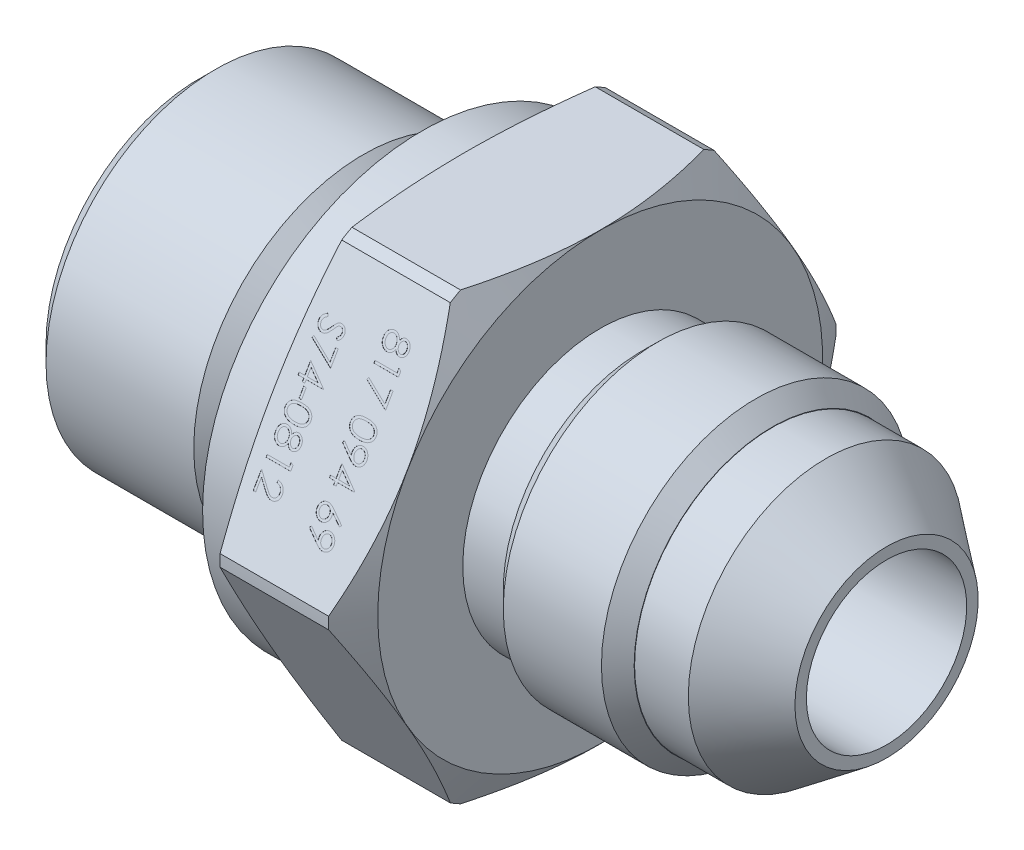
from build123d import *

# Parameters (mm, degrees)
SKETCH2_OUTSIDE_W  = 45.142
SKETCH2_OUTSIDE_H  = 45.142
EXTRUDE1_DEPTH     = 10.9
CHAMFER1_SIZE      = 1
CHAMFER2_SIZE      = 1
SKETCH3_W          = 0.153846154
SKETCH3_H          = 0.576923077
CUT_EXTRUDE1_DEPTH = 0.01
SKETCH4_R          = 1.5


with BuildPart() as part:
    # Sketch1 → Revolve1 (revolve)
    with BuildSketch(Plane.XY, mode=Mode.PRIVATE) as revolve1_sk:
        Polygon((0, 4.9), (0, 10.37), (10.03, 10.37), (12, 8.4), (15.6, 8.4), (15.6, 11.5), (13.6, 11.5), (13.6, 13.4), (16.2, 13.4), (16.762693304, 15.5), (23.4, 15.5), (24.5, 13.594744112), (24.5, 8.4), (27, 8.4), (27, 9.425), (35, 9.425), (35, 8.4), (38.284274499, 8.4), (42, 5.6), (42, 4.9), align=None)
    revolve(revolve1_sk.sketch.rotate(Axis((0, 0, 0), (1, 0, 0)), 90), axis=Axis((0, 0, 0), (1, 0, 0)))

    # Sketch2 outside → Extrude1 (cut)
    with BuildSketch(Plane(origin=(24.5, 0, 0), x_dir=(0, 0, -1), z_dir=(1, 0, 0))):
        Rectangle(SKETCH2_OUTSIDE_W, SKETCH2_OUTSIDE_H)
        Polygon((7.851963661, 13.6), (-7.851963661, 13.6), (-15.703927322, 0), (-7.851963661, -13.6), (7.851963661, -13.6), (15.703927322, 0), align=None, mode=Mode.SUBTRACT)
    extrude(amount=-EXTRUDE1_DEPTH, mode=Mode.SUBTRACT)

    # Chamfer1
    chamfer1_edges = [part.edges().sort_by_distance(p)[0] for p in [
        (0, 0, -10.37),
    ]]
    chamfer(chamfer1_edges, length=CHAMFER1_SIZE)

    # Chamfer2
    chamfer2_edges = [part.edges().sort_by_distance(p)[0] for p in [
        (35, 0, -9.425),
        (27, 0, -9.425),
    ]]
    chamfer(chamfer2_edges, length=CHAMFER2_SIZE)

    # Sketch3 → Cut-Extrude1 (cut)
    # profile 1 of 16: a face of its own
    with BuildSketch(Plane(origin=(0, 6.8, 11.777945491), x_dir=(1, 0, 0), z_dir=(0, 0.5000000000000004, 0.8660254037844384))):
        with BuildLine():
            add(Edge.make_bspline(
                [(21.590756707, 4.405348558), (21.584346899, 4.393174409), (21.571806529, 4.369356483), (21.551679301, 4.335277547), (21.530653771, 4.303901641), (21.509389951, 4.274781616), (21.487047344, 4.248511422), (21.463880976, 4.22491723), (21.440511401, 4.203258827), (21.416024206, 4.184674875), (21.390924446, 4.168287251), (21.364996362, 4.154143799), (21.338321737, 4.14204949), (21.310602806, 4.132465698), (21.282248487, 4.124570556), (21.252892188, 4.119138178), (21.222727476, 4.116216636), (21.20234106, 4.115664288), (21.192018726, 4.115384615)],
                knots=[0, 0, 0, 0, 1.264385854, 2.473688339, 3.635349404, 4.734491366, 5.785876313, 6.801388178, 7.772322209, 8.711311751, 9.622826105, 10.524996139, 11.423212571, 12.31118177, 13.217849097, 14.126010572, 15.051135535, 16, 16, 16, 16], degree=3))
            add(Edge.make_bspline(
                [(21.192018726, 4.115384615), (21.177575849, 4.115712283), (21.148987976, 4.116360861), (21.106811203, 4.122103611), (21.065751506, 4.130485034), (21.026205841, 4.143536723), (20.987678653, 4.159126152), (20.950874381, 4.17918104), (20.914763885, 4.201686994), (20.892557828, 4.2198008), (20.881321611, 4.228966346)],
                knots=[0, 0, 0, 0, 1.02534174, 2.029536028, 3.018826961, 3.997522084, 4.983122576, 5.966563916, 6.971085759, 8, 8, 8, 8], degree=3))
            add(Edge.make_bspline(
                [(20.881321611, 4.228966346), (20.868209993, 4.240896264), (20.842148782, 4.264608678), (20.808312721, 4.305229932), (20.779877266, 4.34981074), (20.756703597, 4.398178596), (20.7386668, 4.450204211), (20.725705721, 4.505876499), (20.718281823, 4.565303993), (20.717208684, 4.606149195), (20.716658149, 4.627103365)],
                knots=[0, 0, 0, 0, 0.954267603, 1.896743057, 2.838368354, 3.796610408, 4.779680527, 5.799409237, 6.871065594, 8, 8, 8, 8], degree=3))
            add(Edge.make_bspline(
                [(20.716658149, 4.627103365), (20.717153394, 4.647251497), (20.718117089, 4.686457713), (20.724610741, 4.743531763), (20.736106984, 4.796798334), (20.751516578, 4.846509963), (20.77206562, 4.892186), (20.797252808, 4.933909327), (20.82650923, 4.972292079), (20.860539974, 5.006127919), (20.896994365, 5.036165392), (20.934601938, 5.062551811), (20.973367729, 5.084483531), (21.012713298, 5.103052293), (21.053190225, 5.117267158), (21.09459023, 5.127112392), (21.136841006, 5.133364955), (21.165354571, 5.13419687), (21.179699014, 5.134615385)],
                knots=[0, 0, 0, 0, 1.256882982, 2.445766618, 3.576898315, 4.651879663, 5.686612882, 6.692806257, 7.686348993, 8.689277895, 9.678883454, 10.630458183, 11.551151498, 12.454054546, 13.341321255, 14.221808008, 15.105437234, 16, 16, 16, 16], degree=3))
            add(Edge.make_bspline(
                [(21.179699014, 5.134615385), (21.19022439, 5.134367733), (21.211026248, 5.133878287), (21.241758702, 5.130490322), (21.271671759, 5.125044478), (21.300873355, 5.117645201), (21.329160327, 5.107629252), (21.356631515, 5.095492697), (21.383497988, 5.081478326), (21.409297879, 5.064680568), (21.434891015, 5.046187054), (21.459027322, 5.024249543), (21.483051385, 5.000189236), (21.505923684, 4.97302378), (21.528743555, 4.943584642), (21.550058774, 4.910979545), (21.571428915, 4.876124542), (21.584203569, 4.85135044), (21.590756707, 4.838641827)],
                knots=[0, 0, 0, 0, 0.941717298, 1.86116577, 2.762973304, 3.660719123, 4.553575492, 5.444450535, 6.34648071, 7.261375261, 8.197060099, 9.168336537, 10.175980388, 11.237504102, 12.343496232, 13.506792996, 14.721035322, 16, 16, 16, 16], degree=3))
            add(Edge.make_bspline(
                [(21.590756707, 4.838641827), (21.600241558, 4.856039932), (21.618606886, 4.889727534), (21.652375535, 4.934304314), (21.688815286, 4.972655388), (21.729130485, 5.003294488), (21.771545498, 5.027606866), (21.815924406, 5.044775428), (21.861735815, 5.055986711), (21.892975892, 5.057122093), (21.908665361, 5.057692308)],
                knots=[0, 0, 0, 0, 1.16709546, 2.25982348, 3.287408737, 4.277418348, 5.234967981, 6.16072867, 7.076276605, 8, 8, 8, 8], degree=3))
            add(Edge.make_bspline(
                [(21.908665361, 5.057692308), (21.924650012, 5.056991398), (21.956781948, 5.055582448), (22.004613404, 5.044189805), (22.051590885, 5.025623224), (22.097493192, 5.000374687), (22.140741581, 4.968910218), (22.179661409, 4.931168905), (22.213459316, 4.887796521), (22.242012895, 4.839563146), (22.265367957, 4.787758095), (22.281311029, 4.733004793), (22.291797082, 4.676281702), (22.292980958, 4.637667656), (22.293581226, 4.618088942)],
                knots=[0, 0, 0, 0, 0.888753872, 1.786550278, 2.720173491, 3.693036334, 4.694165094, 5.687489879, 6.699912706, 7.744713188, 8.800178723, 9.852977058, 10.911381959, 12, 12, 12, 12], degree=3))
            add(Edge.make_bspline(
                [(22.293581226, 4.618088942), (22.29296402, 4.599015191), (22.291746959, 4.561403926), (22.281496809, 4.50603625), (22.264567496, 4.453016069), (22.241516136, 4.402632701), (22.212770397, 4.355987006), (22.178631529, 4.314339622), (22.139848455, 4.2778071), (22.096717194, 4.247454091), (22.050816001, 4.222958946), (22.003077917, 4.20551466), (21.954142644, 4.194418672), (21.921042535, 4.193012311), (21.90445863, 4.192307692)],
                knots=[0, 0, 0, 0, 1.072712831, 2.115267497, 3.156282165, 4.197922255, 5.225560591, 6.230883479, 7.219814004, 8.214446311, 9.19021444, 10.138875805, 11.067534608, 12, 12, 12, 12], degree=3))
            add(Edge.make_bspline(
                [(21.90445863, 4.192307692), (21.88818282, 4.192922416), (21.856218055, 4.194129697), (21.809622352, 4.204288074), (21.765979198, 4.221389078), (21.724824561, 4.244761554), (21.686727836, 4.275176544), (21.651815688, 4.312581945), (21.618700275, 4.355816911), (21.600279438, 4.388468947), (21.590756707, 4.405348558)],
                knots=[0, 0, 0, 0, 0.975287281, 1.915408787, 2.843441052, 3.776938647, 4.743139116, 5.754296123, 6.83907365, 8, 8, 8, 8], degree=3))
        make_face()
        with BuildLine():
            add(Edge.make_bspline(
                [(22.139735072, 4.625600962), (22.139455883, 4.636122735), (22.138909668, 4.656707926), (22.136055966, 4.686891642), (22.130504588, 4.715594085), (22.123116569, 4.743115143), (22.113136002, 4.769077491), (22.101395284, 4.793833728), (22.087121256, 4.816962524), (22.071109314, 4.838743083), (22.053498068, 4.858350557), (22.035149332, 4.875752508), (22.015702735, 4.890207414), (21.99564201, 4.902482175), (21.974371763, 4.91138854), (21.952544116, 4.918058956), (21.929883237, 4.922568124), (21.914396161, 4.922906005), (21.906561995, 4.923076923)],
                knots=[0, 0, 0, 0, 1.203892937, 2.355340988, 3.463153438, 4.544400666, 5.610487187, 6.640501085, 7.674077295, 8.714426146, 9.728707835, 10.68524104, 11.601827946, 12.495867327, 13.368432065, 14.231010473, 15.105153427, 16, 16, 16, 16], degree=3))
            add(Edge.make_bspline(
                [(21.906561995, 4.923076923), (21.898731021, 4.922772164), (21.883255891, 4.922169916), (21.860311851, 4.917810827), (21.838058342, 4.910522394), (21.816287623, 4.900528385), (21.795055575, 4.887702945), (21.774280837, 4.872136691), (21.754512782, 4.853154207), (21.735190551, 4.832191816), (21.717388693, 4.809294114), (21.7014871, 4.785232794), (21.688810489, 4.759832256), (21.677695693, 4.733853186), (21.669358306, 4.706746189), (21.663351711, 4.678698169), (21.659636257, 4.649739087), (21.659191082, 4.630119171), (21.658965841, 4.620192308)],
                knots=[0, 0, 0, 0, 0.873213166, 1.72559466, 2.594724523, 3.479581045, 4.391597569, 5.35687048, 6.368548091, 7.443976143, 8.534559525, 9.600545123, 10.654815915, 11.696401765, 12.749428718, 13.812189468, 14.893058657, 16, 16, 16, 16], degree=3))
            add(Edge.make_bspline(
                [(21.658965841, 4.620192308), (21.659339927, 4.607442263), (21.660084404, 4.582068106), (21.667006336, 4.544662678), (21.677894586, 4.508292973), (21.692791715, 4.473347728), (21.711489369, 4.440731478), (21.733874948, 4.411657163), (21.759431561, 4.38637278), (21.787761348, 4.36514109), (21.817912029, 4.348679727), (21.848169297, 4.335864667), (21.878855967, 4.328381289), (21.899413238, 4.327405188), (21.909566803, 4.326923077)],
                knots=[0, 0, 0, 0, 1.076279235, 2.141928126, 3.20205304, 4.278698113, 5.344010996, 6.36967002, 7.368914609, 8.37248503, 9.349703398, 10.264243087, 11.142681841, 12, 12, 12, 12], degree=3))
            add(Edge.make_bspline(
                [(21.909566803, 4.326923077), (21.916693448, 4.327150444), (21.930838816, 4.327601734), (21.951721633, 4.331338996), (21.972153672, 4.337466869), (21.992139885, 4.345919146), (22.011961315, 4.356390015), (22.030781172, 4.369916451), (22.049646823, 4.385271238), (22.067722207, 4.403108438), (22.084742379, 4.423216937), (22.099384104, 4.445914194), (22.112100206, 4.470622859), (22.122317768, 4.497544514), (22.130013189, 4.52657411), (22.135769939, 4.557600765), (22.13901604, 4.590876631), (22.139490196, 4.613775142), (22.139735072, 4.625600962)],
                knots=[0, 0, 0, 0, 0.814272661, 1.61621452, 2.416847352, 3.248328223, 4.093649164, 4.973549185, 5.892801723, 6.872536627, 7.872406081, 8.898230315, 9.953166191, 11.044090313, 12.18293744, 13.382234284, 14.648068262, 16, 16, 16, 16], degree=3))
        make_face(mode=Mode.SUBTRACT)
        with BuildLine():
            add(Edge.make_bspline(
                [(21.505119688, 4.616887019), (21.504882502, 4.630226689), (21.504417202, 4.656395867), (21.499234723, 4.694733875), (21.492026729, 4.731530549), (21.481068283, 4.766647334), (21.466936991, 4.800041181), (21.449647719, 4.831787312), (21.429516047, 4.861930649), (21.406431986, 4.889977292), (21.381431363, 4.915530706), (21.355303003, 4.938343488), (21.327859234, 4.957332564), (21.299344865, 4.97284911), (21.269795417, 4.984868708), (21.239216826, 4.993743845), (21.207517693, 4.998895732), (21.186027178, 4.999629858), (21.175191803, 5)],
                knots=[0, 0, 0, 0, 1.140506561, 2.237395584, 3.304560074, 4.345354409, 5.3782877, 6.402081073, 7.433555996, 8.474808822, 9.504965884, 10.489266388, 11.437701257, 12.354123303, 13.261162422, 14.161620169, 15.073101032, 16, 16, 16, 16], degree=3))
            add(Edge.make_bspline(
                [(21.175191803, 5), (21.161720552, 4.999417358), (21.134993906, 4.99826141), (21.095508243, 4.989041786), (21.05717442, 4.974360113), (21.020666929, 4.953377796), (20.986440551, 4.927939935), (20.956264018, 4.896864266), (20.930029774, 4.86136549), (20.908519059, 4.821089499), (20.891264131, 4.777155236), (20.879523529, 4.729448836), (20.87169257, 4.67864383), (20.870906634, 4.643560551), (20.870504303, 4.625600962)],
                knots=[0, 0, 0, 0, 0.898956152, 1.783507998, 2.694187257, 3.631865312, 4.587204618, 5.533364321, 6.51415483, 7.525942309, 8.574485006, 9.65837228, 10.801290154, 12, 12, 12, 12], degree=3))
            add(Edge.make_bspline(
                [(20.870504303, 4.625600962), (20.870773487, 4.611564969), (20.871297944, 4.584218354), (20.875936869, 4.54432605), (20.883271656, 4.506672424), (20.894041855, 4.471275952), (20.906945205, 4.437712455), (20.923820055, 4.406732476), (20.942904116, 4.377510857), (20.965555243, 4.351419354), (20.989779358, 4.327691106), (21.015291741, 4.306908207), (21.041832567, 4.289319191), (21.069387404, 4.275140825), (21.097854708, 4.263881831), (21.127351412, 4.255765382), (21.157993354, 4.250762985), (21.178778516, 4.250256656), (21.189314399, 4.25)],
                knots=[0, 0, 0, 0, 1.22469164, 2.386092043, 3.500511288, 4.568136916, 5.611981868, 6.63276519, 7.641422348, 8.65223666, 9.641383647, 10.598487484, 11.519869765, 12.415254456, 13.298392158, 14.187051141, 15.081026348, 16, 16, 16, 16], degree=3))
            add(Edge.make_bspline(
                [(21.189314399, 4.25), (21.199548692, 4.250385677), (21.219728931, 4.251146164), (21.249612231, 4.256041643), (21.278600322, 4.264447232), (21.306568465, 4.276697926), (21.333818939, 4.291764676), (21.360150403, 4.310246054), (21.38535404, 4.332358563), (21.409456136, 4.357404568), (21.431750349, 4.384683666), (21.451470362, 4.413684742), (21.468078533, 4.444179282), (21.48158557, 4.476104148), (21.49220878, 4.509388084), (21.499629918, 4.544006708), (21.504301178, 4.580000524), (21.504843768, 4.604452612), (21.505119688, 4.616887019)],
                knots=[0, 0, 0, 0, 0.917481483, 1.809113215, 2.707052678, 3.61610275, 4.54058801, 5.494688304, 6.493986409, 7.541809048, 8.607637092, 9.648666143, 10.681335566, 11.715370464, 12.751897579, 13.808646822, 14.885650252, 16, 16, 16, 16], degree=3))
        make_face(mode=Mode.SUBTRACT)
    # profile 2 of 16: a face of its own
    with BuildSketch(Plane(origin=(0, 6.8, 11.777945491), x_dir=(1, 0, 0), z_dir=(0, 0.5000000000000004, 0.8660254037844384))):
        Polygon((22.255119688, 3.661959135), (22.255119688, 3.384615385), (20.755119688, 3.384615385), (20.755119688, 3.519230769), (22.101273534, 3.519230769), (22.101273534, 3.75), align=None)
    # profile 3 of 16: a face of its own
    with BuildSketch(Plane(origin=(0, 6.8, 11.777945491), x_dir=(1, 0, 0), z_dir=(0, 0.5000000000000004, 0.8660254037844384))):
        Polygon((22.255119688, 2.730769231), (22.255119688, 1.807692308), (20.716658149, 2.596153846), (20.780660553, 2.712439904), (22.101273534, 2.035456731), (22.101273534, 2.730769231), align=None)
    # profile 4 of 16: a face of its own
    with BuildSketch(Plane(origin=(0, 6.8, 11.777945491), x_dir=(1, 0, 0), z_dir=(0, 0.5000000000000004, 0.8660254037844384))):
        with BuildLine():
            add(Edge.make_bspline(
                [(21.504518726, 1.096153846), (21.528560464, 1.096013267), (21.575261885, 1.09574019), (21.643312446, 1.092702295), (21.70715257, 1.08765572), (21.766785312, 1.080739702), (21.822226072, 1.072323428), (21.87332667, 1.061088208), (21.920323683, 1.048311334), (21.963370147, 1.033503003), (22.003046745, 1.016794431), (22.040084569, 0.998606627), (22.074436599, 0.978227715), (22.106618893, 0.956787588), (22.136272281, 0.933502769), (22.163340607, 0.908618853), (22.187840216, 0.881889003), (22.210062694, 0.853841874), (22.229421306, 0.824300217), (22.246864702, 0.794174701), (22.261181563, 0.762933739), (22.272945429, 0.730862256), (22.282371516, 0.698053521), (22.288899064, 0.664371971), (22.292990081, 0.629809468), (22.293382308, 0.606481972), (22.293581226, 0.594651442)],
                knots=[0, 0, 0, 0, 1.646377244, 3.198111528, 4.663803227, 6.031090796, 7.308794487, 8.502186765, 9.612154809, 10.642545331, 11.617106989, 12.558866172, 13.465886467, 14.35053239, 15.20542558, 16.045215227, 16.865619885, 17.686225247, 18.492864914, 19.282407821, 20.068097601, 20.842842034, 21.620163247, 22.403093475, 23.190129512, 24, 24, 24, 24], degree=3))
            add(Edge.make_bspline(
                [(22.293581226, 0.594651442), (22.293372162, 0.582721952), (22.292956401, 0.558997948), (22.288960425, 0.523923501), (22.282329944, 0.489659352), (22.27293524, 0.456351578), (22.26127995, 0.423726584), (22.246671186, 0.392039552), (22.229665957, 0.36109366), (22.209684295, 0.33138068), (22.187406177, 0.302574416), (22.162222176, 0.275382432), (22.134386582, 0.249802252), (22.104197212, 0.225512835), (22.071075033, 0.203203294), (22.035596128, 0.181957537), (21.997140044, 0.16294095), (21.956348415, 0.14462609), (21.912092561, 0.128817381), (21.864621949, 0.114560419), (21.813375869, 0.103040861), (21.758623192, 0.093445458), (21.700162842, 0.086011931), (21.638120136, 0.080597942), (21.572454254, 0.077738048), (21.527558033, 0.077199462), (21.504518726, 0.076923077)],
                knots=[0, 0, 0, 0, 0.810914788, 1.612654377, 2.396697861, 3.181598691, 3.963628158, 4.749916497, 5.551656086, 6.361998678, 7.18212741, 8.025565596, 8.878627764, 9.750805457, 10.657531673, 11.591944965, 12.560506719, 13.57287815, 14.630710178, 15.753379473, 16.941251878, 18.199788006, 19.531962791, 20.947069417, 22.433333509, 24, 24, 24, 24], degree=3))
            add(Edge.make_bspline(
                [(21.504518726, 0.076923077), (21.481579994, 0.077202673), (21.43688481, 0.077747453), (21.371513207, 0.080562131), (21.309803923, 0.086132582), (21.251585183, 0.093022352), (21.19720265, 0.102836734), (21.146139212, 0.113993956), (21.098835538, 0.127861186), (21.054813086, 0.143454421), (21.01422131, 0.161371868), (20.976097659, 0.180556526), (20.940647704, 0.201671872), (20.907526007, 0.224114462), (20.877074816, 0.248197422), (20.849218874, 0.273885919), (20.823976553, 0.301199505), (20.801394046, 0.330070897), (20.781644985, 0.360251304), (20.763992501, 0.391093903), (20.749668605, 0.423214283), (20.737574661, 0.455898596), (20.728158345, 0.489455238), (20.721711057, 0.523851297), (20.717176796, 0.558974124), (20.71683163, 0.582717824), (20.716658149, 0.594651442)],
                knots=[0, 0, 0, 0, 1.56130642, 3.042141888, 4.451772327, 5.777565838, 7.030558081, 8.211376819, 9.333164717, 10.383253789, 11.387583522, 12.350962576, 13.286244149, 14.193812918, 15.072134482, 15.925989337, 16.770211267, 17.600669898, 18.417446232, 19.22325363, 20.01647746, 20.807971184, 21.593601364, 22.38506573, 23.188331689, 24, 24, 24, 24], degree=3))
            add(Edge.make_bspline(
                [(20.716658149, 0.594651442), (20.716858981, 0.606481492), (20.717254983, 0.62980804), (20.721318352, 0.664377485), (20.727944337, 0.698006506), (20.736942393, 0.730762329), (20.748378388, 0.762711989), (20.76292455, 0.793542509), (20.779795835, 0.823661054), (20.79899008, 0.852930191), (20.820986184, 0.880792068), (20.845313221, 0.907406318), (20.872581364, 0.932100941), (20.902354145, 0.955093928), (20.934378939, 0.976913024), (20.968971217, 0.997092238), (21.006356064, 1.015244565), (21.046251689, 1.032327591), (21.089614524, 1.047386246), (21.136862199, 1.060587517), (21.188256077, 1.071592624), (21.243643585, 1.080442987), (21.303066178, 1.087739222), (21.366628482, 1.092678399), (21.434275656, 1.095742609), (21.480677097, 1.096014266), (21.504518726, 1.096153846)],
                knots=[0, 0, 0, 0, 0.810940842, 1.599017053, 2.38298203, 3.159479784, 3.926441347, 4.70693857, 5.494146311, 6.292334103, 7.104379492, 7.925868426, 8.762126819, 9.623561095, 10.503686106, 11.41783325, 12.366995289, 13.351843594, 14.392337808, 15.512229747, 16.713911458, 17.994391108, 19.357476964, 20.818259213, 22.365182633, 24, 24, 24, 24], degree=3))
        make_face()
        with BuildLine():
            add(Edge.make_bspline(
                [(21.505119688, 0.961538462), (21.485084531, 0.96148727), (21.446200226, 0.961387917), (21.389695971, 0.958792402), (21.336994402, 0.955256589), (21.288028601, 0.950696032), (21.242964307, 0.943923344), (21.201491597, 0.936334707), (21.163829885, 0.927099855), (21.129720953, 0.916173275), (21.098585196, 0.90372844), (21.069614791, 0.890138492), (21.042458496, 0.875547128), (21.017392129, 0.859188662), (20.994166173, 0.841434139), (20.972847373, 0.822254404), (20.953528747, 0.80168319), (20.930605324, 0.773205886), (20.906636821, 0.735795685), (20.886022078, 0.68841847), (20.872983187, 0.639715019), (20.87132964, 0.60664867), (20.870504303, 0.590144231)],
                knots=[0, 0, 0, 0, 1.459116078, 2.831857795, 4.118796693, 5.306371758, 6.412361096, 7.436813035, 8.376339383, 9.234574298, 10.043323891, 10.816788787, 11.564361537, 12.286735248, 12.994408768, 13.691741332, 14.372975427, 15.047457468, 16.352811911, 17.594285292, 18.799233213, 20, 20, 20, 20], degree=3))
            add(Edge.make_bspline(
                [(20.870504303, 0.590144231), (20.871189066, 0.5735338), (20.872557179, 0.540347233), (20.885756638, 0.491861321), (20.905672155, 0.444791205), (20.929221085, 0.407903231), (20.951647512, 0.379839283), (20.970768076, 0.359732002), (20.992177733, 0.341276838), (21.015277432, 0.323773092), (21.040508496, 0.307719202), (21.0677496, 0.293120715), (21.09707639, 0.27979928), (21.117549136, 0.272209689), (21.128016322, 0.268329327)],
                knots=[0, 0, 0, 0, 1.353760809, 2.704726607, 4.075137775, 5.516104923, 6.260822281, 7.007110065, 7.778089737, 8.566572457, 9.372053459, 10.217411131, 11.088608312, 12, 12, 12, 12], degree=3))
            add(Edge.make_bspline(
                [(21.128016322, 0.268329327), (21.141400496, 0.263807141), (21.168576109, 0.254625163), (21.21073196, 0.242791546), (21.254961716, 0.233472089), (21.301001052, 0.225087789), (21.349189495, 0.219365051), (21.399377946, 0.214758845), (21.451604244, 0.212045694), (21.487087811, 0.211709372), (21.505119688, 0.211538462)],
                knots=[0, 0, 0, 0, 0.884706709, 1.796334032, 2.740027952, 3.714592787, 4.726048262, 5.777819803, 6.87074269, 8, 8, 8, 8], degree=3))
            add(Edge.make_bspline(
                [(21.505119688, 0.211538462), (21.523151176, 0.211726958), (21.558428986, 0.212095742), (21.610040453, 0.214518687), (21.659145886, 0.218412158), (21.70578983, 0.223681885), (21.749889264, 0.230916107), (21.791507295, 0.239603688), (21.830632703, 0.249788879), (21.867366389, 0.261471597), (21.901576322, 0.274637858), (21.933336983, 0.289182629), (21.96281675, 0.30470387), (21.989931003, 0.321565425), (22.014802131, 0.339563425), (22.036931233, 0.359173841), (22.057004222, 0.379618563), (22.079916751, 0.408254503), (22.103278906, 0.445743482), (22.124778517, 0.492391617), (22.137124929, 0.540936179), (22.138865652, 0.573753374), (22.139735072, 0.590144231)],
                knots=[0, 0, 0, 0, 1.313668642, 2.570134578, 3.763346207, 4.902004944, 5.98888779, 7.017888835, 7.998425394, 8.933058446, 9.82474457, 10.667209444, 11.476765193, 12.250262638, 12.991704352, 13.7104269, 14.401925311, 15.076585796, 16.378385137, 17.609787933, 18.806186071, 20, 20, 20, 20], degree=3))
            add(Edge.make_bspline(
                [(22.139735072, 0.590144231), (22.138865574, 0.606735181), (22.137124993, 0.639947307), (22.124810893, 0.688985877), (22.103479073, 0.735966309), (22.079765886, 0.773154518), (22.057409838, 0.801754329), (22.037968934, 0.821949787), (22.016585641, 0.840830439), (21.993458018, 0.858599754), (21.968379009, 0.874942472), (21.941226663, 0.889539808), (21.912253566, 0.903121955), (21.881124893, 0.915593508), (21.846964539, 0.926418827), (21.809492902, 0.936094666), (21.767981455, 0.943678699), (21.722791173, 0.950296847), (21.673765178, 0.95534281), (21.620942106, 0.958783326), (21.564340138, 0.961392613), (21.525255206, 0.961488872), (21.505119688, 0.961538462)],
                knots=[0, 0, 0, 0, 1.207964612, 2.418129846, 3.655795183, 4.951004962, 5.620895151, 6.296795572, 6.989224116, 7.696855977, 8.419187164, 9.166715907, 9.940135271, 10.748837255, 11.607021648, 12.548275234, 13.5654991, 14.678641405, 15.874140913, 17.15372626, 18.533675393, 20, 20, 20, 20], degree=3))
        make_face(mode=Mode.SUBTRACT)
    # profile 5 of 16: a face of its own
    with BuildSketch(Plane(origin=(0, 6.8, 11.777945491), x_dir=(1, 0, 0), z_dir=(0, 0.5000000000000004, 0.8660254037844384))):
        with BuildLine():
            Line((20.716658149, -0.384615385), (20.791477861, -0.277043269))
            Line((20.791477861, -0.277043269), (21.401153341, -0.694110577))
            add(Edge.make_bspline(
                [(21.401153341, -0.694110577), (21.397899171, -0.667500262), (21.391491529, -0.615103067), (21.390314392, -0.562330024), (21.389735072, -0.536358173)],
                knots=[0, 0, 0, 0, 1.015715272, 2, 2, 2, 2], degree=3))
            add(Edge.make_bspline(
                [(21.389735072, -0.536358173), (21.390139587, -0.520612017), (21.390933613, -0.489703689), (21.397191663, -0.444255357), (21.406939308, -0.400520229), (21.421147166, -0.358664893), (21.439305182, -0.318726635), (21.461424014, -0.280566088), (21.487585996, -0.24423378), (21.51750991, -0.210157234), (21.55037314, -0.179167008), (21.585153816, -0.151556889), (21.622257885, -0.128610724), (21.660927958, -0.109549321), (21.701719971, -0.095093415), (21.744169712, -0.084566613), (21.788574702, -0.078085604), (21.818799758, -0.077314563), (21.83414613, -0.076923077)],
                knots=[0, 0, 0, 0, 1.060702494, 2.082066239, 3.085748733, 4.076089625, 5.054723785, 6.037561548, 7.043420247, 8.066922603, 9.088643095, 10.08373341, 11.053858765, 12.022809492, 12.983497605, 13.964038393, 14.966267459, 16, 16, 16, 16], degree=3))
            add(Edge.make_bspline(
                [(21.83414613, -0.076923077), (21.855132695, -0.077666406), (21.896325066, -0.079125411), (21.956510967, -0.090867632), (22.013419486, -0.110179206), (22.066900997, -0.137105653), (22.116186171, -0.171020534), (22.160589861, -0.211781358), (22.199480513, -0.2591402), (22.232910831, -0.312018208), (22.259797259, -0.369169503), (22.279614102, -0.429027499), (22.291270708, -0.491133551), (22.292807506, -0.533205409), (22.293581226, -0.554387019)],
                knots=[0, 0, 0, 0, 1.022988612, 2.007919123, 2.978103895, 3.94594894, 4.918897164, 5.887013414, 6.875921846, 7.89917871, 8.930658928, 9.948724884, 10.967259574, 12, 12, 12, 12], degree=3))
            add(Edge.make_bspline(
                [(22.293581226, -0.554387019), (22.292799689, -0.57516858), (22.291255445, -0.616230986), (22.27984655, -0.676694099), (22.260822969, -0.73465604), (22.234412801, -0.789660776), (22.201093711, -0.840325964), (22.161718666, -0.886060885), (22.115843999, -0.925640296), (22.064724516, -0.958996158), (22.009794696, -0.98576829), (21.952459022, -1.005085178), (21.893128065, -1.016976116), (21.852930444, -1.018474548), (21.832643726, -1.019230769)],
                knots=[0, 0, 0, 0, 1.026337322, 2.02794581, 3.027878252, 4.032696425, 5.033228651, 6.015458494, 7.004668777, 8.016190509, 9.023163053, 10.0152653, 10.998354841, 12, 12, 12, 12], degree=3))
            add(Edge.make_bspline(
                [(21.832643726, -1.019230769), (21.816895137, -1.018731975), (21.784953062, -1.017720295), (21.736468809, -1.010452467), (21.686930824, -0.998681373), (21.644946479, -0.985027406), (21.610622721, -0.971045704), (21.583077036, -0.959016287), (21.554330959, -0.945014965), (21.524595761, -0.928383445), (21.493089111, -0.910995795), (21.460499079, -0.891225715), (21.426643548, -0.869674879), (21.403824047, -0.854318058), (21.392138918, -0.846454327)],
                knots=[0, 0, 0, 0, 1.179688711, 2.392703466, 3.66501481, 4.991562144, 5.695278944, 6.441221078, 7.243328977, 8.089575748, 8.993388627, 9.939305498, 10.944784961, 12, 12, 12, 12], degree=3))
            Line((21.392138918, -0.846454327), (20.716658149, -0.384615385))
        make_face()
        with BuildLine():
            add(Edge.make_bspline(
                [(21.543581226, -0.561298077), (21.543907105, -0.57322694), (21.54454148, -0.596448381), (21.548402584, -0.630467224), (21.555248578, -0.662577597), (21.565071311, -0.692865275), (21.576924169, -0.721633947), (21.592015021, -0.748426659), (21.61002215, -0.773265834), (21.630255014, -0.796317803), (21.652733835, -0.816788089), (21.676261167, -0.835020816), (21.700940285, -0.850518202), (21.727080255, -0.862759607), (21.754044773, -0.872824425), (21.782268068, -0.879775001), (21.811603097, -0.88362543), (21.831531093, -0.884281819), (21.841658149, -0.884615385)],
                knots=[0, 0, 0, 0, 1.163407946, 2.26475976, 3.333800367, 4.359385343, 5.366239384, 6.363380779, 7.350133999, 8.353570782, 9.349036268, 10.310270964, 11.253520213, 12.184142, 13.120487599, 14.056272588, 15.012232024, 16, 16, 16, 16], degree=3))
            add(Edge.make_bspline(
                [(21.841658149, -0.884615385), (21.851789456, -0.88432841), (21.87175444, -0.88376289), (21.901132582, -0.879225101), (21.92928802, -0.871244257), (21.956367783, -0.860528843), (21.982175994, -0.846439741), (22.006880994, -0.829470212), (22.030788149, -0.809704954), (22.052666207, -0.78650908), (22.073093982, -0.761552527), (22.090802692, -0.734718676), (22.105919031, -0.706673136), (22.118286222, -0.67739356), (22.12795616, -0.646819003), (22.134905112, -0.614947812), (22.138750517, -0.581624315), (22.139402707, -0.55900373), (22.139735072, -0.547475962)],
                knots=[0, 0, 0, 0, 0.972051712, 1.915547132, 2.843788449, 3.775556853, 4.704594175, 5.659091977, 6.648619647, 7.675179132, 8.714041218, 9.74046568, 10.755438548, 11.767722258, 12.786148662, 13.828784001, 14.893517844, 16, 16, 16, 16], degree=3))
            add(Edge.make_bspline(
                [(22.139735072, -0.547475962), (22.139402231, -0.536048421), (22.138749199, -0.513627681), (22.134911741, -0.48060084), (22.127911901, -0.448943641), (22.118281552, -0.418463212), (22.105986299, -0.389245352), (22.090802807, -0.361422899), (22.072999391, -0.334868665), (22.052692219, -0.309919231), (22.030683117, -0.286773092), (22.006985454, -0.266659746), (21.982162914, -0.249729538), (21.956371259, -0.235620901), (21.929287093, -0.224910684), (21.901132833, -0.216928448), (21.871754374, -0.212391033), (21.851789434, -0.211825463), (21.841658149, -0.211538462)],
                knots=[0, 0, 0, 0, 1.099545523, 2.15729926, 3.193054709, 4.213957097, 5.228701859, 6.237665598, 7.258567987, 8.299955741, 9.329010984, 10.327149711, 11.283968076, 12.215264062, 13.149297769, 14.079795814, 15.025585048, 16, 16, 16, 16], degree=3))
            add(Edge.make_bspline(
                [(21.841658149, -0.211538462), (21.831523207, -0.211798144), (21.811535246, -0.212310286), (21.782166791, -0.217250767), (21.754014708, -0.225512887), (21.726805262, -0.23657834), (21.700803038, -0.25115045), (21.676131311, -0.269032099), (21.652510404, -0.289991619), (21.630307313, -0.313748828), (21.609927809, -0.339749468), (21.592129074, -0.367519503), (21.577098026, -0.396580861), (21.565037433, -0.427035846), (21.55534672, -0.45865876), (21.548415201, -0.491733816), (21.544578515, -0.526151632), (21.543916845, -0.549470196), (21.543581226, -0.561298077)],
                knots=[0, 0, 0, 0, 0.952633368, 1.87876736, 2.791047057, 3.707742249, 4.635551637, 5.587206343, 6.568248508, 7.601284464, 8.641511608, 9.671105535, 10.699146789, 11.713763218, 12.747829548, 13.806491675, 14.887386225, 16, 16, 16, 16], degree=3))
        make_face(mode=Mode.SUBTRACT)
    # profile 6 of 16: a face of its own
    with BuildSketch(Plane(origin=(0, 6.8, 11.777945491), x_dir=(1, 0, 0), z_dir=(0, 0.5000000000000004, 0.8660254037844384))):
        Polygon((22.293581226, -2.030348558), (22.293581226, -2.057692308), (21.255119688, -2.057692308), (21.255119688, -2.230769231), (21.101273534, -2.230769231), (21.101273534, -2.057692308), (20.755119688, -2.057692308), (20.755119688, -1.923076923), (21.101273534, -1.923076923), (21.101273534, -1.211538462), align=None)
        Polygon((21.255119688, -1.923076923), (21.906561995, -1.923076923), (21.255119688, -1.475961538), align=None, mode=Mode.SUBTRACT)
    # profile 7 of 16: a face of its own
    with BuildSketch(Plane(origin=(0, 6.8, 11.777945491), x_dir=(1, 0, 0), z_dir=(0, 0.5000000000000004, 0.8660254037844384))):
        with BuildLine():
            Line((22.293581226, -3.634615385), (22.212150938, -3.73828125))
            Line((22.212150938, -3.73828125), (21.606081226, -3.341947115))
            add(Edge.make_bspline(
                [(21.606081226, -3.341947115), (21.610287166, -3.368334377), (21.618491328, -3.419805714), (21.619844734, -3.471905385), (21.620504303, -3.497295673)],
                knots=[0, 0, 0, 0, 1.025318673, 2, 2, 2, 2], degree=3))
            add(Edge.make_bspline(
                [(21.620504303, -3.497295673), (21.620094541, -3.512541029), (21.619287936, -3.542551057), (21.613080572, -3.586611115), (21.603298381, -3.628949231), (21.589038842, -3.669389922), (21.570823548, -3.708078343), (21.548992603, -3.745236512), (21.52241874, -3.780165945), (21.492733759, -3.813316451), (21.459855052, -3.843413778), (21.424968764, -3.870060659), (21.388111244, -3.89244357), (21.349301159, -3.910603822), (21.308598333, -3.924705913), (21.266054845, -3.934986332), (21.221641357, -3.9410633), (21.191436425, -3.941888511), (21.176093245, -3.942307692)],
                knots=[0, 0, 0, 0, 1.04369286, 2.054478336, 3.041073146, 4.015093852, 4.984733326, 5.965804835, 6.960378782, 7.985147595, 9.009457201, 10.008161701, 10.986880575, 11.956520048, 12.937015923, 13.931873656, 14.949455224, 16, 16, 16, 16], degree=3))
            add(Edge.make_bspline(
                [(21.176093245, -3.942307692), (21.155114422, -3.941524894), (21.113857403, -3.939985441), (21.053515654, -3.928778877), (20.996490759, -3.909438852), (20.942558619, -3.883564218), (20.893288394, -3.849993914), (20.848761321, -3.810211258), (20.809949437, -3.763840193), (20.776654338, -3.711978795), (20.750201424, -3.655848658), (20.730644245, -3.596994372), (20.718958333, -3.535918993), (20.717428404, -3.494440408), (20.716658149, -3.473557692)],
                knots=[0, 0, 0, 0, 1.031881447, 2.029301251, 3.006342947, 3.987068354, 4.962916383, 5.929513747, 6.915671209, 7.928552063, 8.953527267, 9.960179832, 10.973036711, 12, 12, 12, 12], degree=3))
            add(Edge.make_bspline(
                [(20.716658149, -3.473557692), (20.717313093, -3.453373388), (20.718610421, -3.413391816), (20.730167276, -3.354577818), (20.7488988, -3.298064881), (20.774705264, -3.244250243), (20.807300218, -3.194395534), (20.846545921, -3.1498071), (20.891574999, -3.110640075), (20.942525585, -3.078216708), (20.996922726, -3.051791575), (21.054160335, -3.033153547), (21.113086482, -3.021100286), (21.153198201, -3.019856729), (21.173388918, -3.019230769)],
                knots=[0, 0, 0, 0, 1.011913813, 2.004424092, 2.994488568, 3.992479987, 4.990471406, 5.973328987, 6.963763268, 7.974390938, 8.994854117, 9.989689954, 10.988086187, 12, 12, 12, 12], degree=3))
            add(Edge.make_bspline(
                [(21.173388918, -3.019230769), (21.188830972, -3.01977439), (21.220346665, -3.020883866), (21.268216139, -3.027505089), (21.317004953, -3.03964922), (21.358364518, -3.052791825), (21.392617732, -3.065833257), (21.41966659, -3.077925572), (21.448231053, -3.091446254), (21.477770652, -3.107294376), (21.509129399, -3.124094665), (21.541145983, -3.143719308), (21.574989748, -3.164197925), (21.597522401, -3.179200038), (21.609086034, -3.186899038)],
                knots=[0, 0, 0, 0, 1.17367173, 2.395347028, 3.66355231, 4.98980831, 5.690886799, 6.447442954, 7.240630024, 8.091733897, 8.994365608, 9.943299771, 10.944512865, 12, 12, 12, 12], degree=3))
            Line((21.609086034, -3.186899038), (22.293581226, -3.634615385))
        make_face()
        with BuildLine():
            add(Edge.make_bspline(
                [(21.466658149, -3.469050481), (21.466320285, -3.457624163), (21.465657397, -3.435205821), (21.461913405, -3.402356365), (21.454819567, -3.371350432), (21.445643523, -3.341833882), (21.433149698, -3.314114357), (21.418153565, -3.287875658), (21.400324144, -3.26337815), (21.379860228, -3.241052052), (21.357782473, -3.220551179), (21.333993549, -3.202917081), (21.30922025, -3.18768932), (21.283229734, -3.175312419), (21.256038676, -3.165673541), (21.227770345, -3.158701508), (21.198235664, -3.154821309), (21.178207446, -3.154175784), (21.167980264, -3.153846154)],
                knots=[0, 0, 0, 0, 1.129474985, 2.216020618, 3.260639938, 4.268601163, 5.26556745, 6.258792394, 7.250684778, 8.252748164, 9.247500881, 10.223461414, 11.174097059, 12.117127289, 13.062595836, 14.020469732, 14.98917545, 16, 16, 16, 16], degree=3))
            add(Edge.make_bspline(
                [(21.167980264, -3.153846154), (21.157844945, -3.154115286), (21.137971091, -3.154643015), (21.108677366, -3.15941271), (21.080513056, -3.166750481), (21.053457561, -3.177491035), (21.027658465, -3.190962829), (21.00293251, -3.207541358), (20.979262629, -3.226945906), (20.957245692, -3.249503308), (20.937051223, -3.273829279), (20.91907003, -3.299555605), (20.903970636, -3.326600486), (20.892033374, -3.355118242), (20.882256473, -3.384709603), (20.875371624, -3.415600311), (20.871480337, -3.447817508), (20.870833918, -3.46964116), (20.870504303, -3.480769231)],
                knots=[0, 0, 0, 0, 0.989642335, 1.94054129, 2.892446913, 3.828371744, 4.778262963, 5.730973156, 6.732161388, 7.763274768, 8.805796303, 9.818398792, 10.825975928, 11.825728216, 12.834635236, 13.867465554, 14.912602056, 16, 16, 16, 16], degree=3))
            add(Edge.make_bspline(
                [(20.870504303, -3.480769231), (20.870833892, -3.49189732), (20.871480261, -3.513721008), (20.875371915, -3.545937946), (20.882255406, -3.576829612), (20.892037243, -3.60641749), (20.903956285, -3.6349481), (20.919164645, -3.662016654), (20.936941896, -3.687988598), (20.95728045, -3.712298611), (20.979138223, -3.734950297), (21.003146825, -3.753900348), (21.027461947, -3.771002629), (21.053560369, -3.78395701), (21.080496768, -3.79481718), (21.108681729, -3.802117929), (21.137969949, -3.806897495), (21.157844559, -3.807423867), (21.167980264, -3.807692308)],
                knots=[0, 0, 0, 0, 1.087205562, 2.132157158, 3.164804748, 4.173533273, 5.173108684, 6.180507559, 7.20098426, 8.243321352, 9.274252308, 10.269075238, 11.227079059, 12.172305571, 13.108064818, 14.05980203, 15.010532752, 16, 16, 16, 16], degree=3))
            add(Edge.make_bspline(
                [(21.167980264, -3.807692308), (21.178221975, -3.807459217), (21.198323122, -3.807001735), (21.227743735, -3.80172716), (21.256268544, -3.794602968), (21.283254981, -3.783089622), (21.309449328, -3.769376287), (21.334102934, -3.751906398), (21.357914237, -3.731876744), (21.380006651, -3.70868046), (21.40021417, -3.68344498), (21.418050693, -3.656608887), (21.433104368, -3.628534263), (21.445664524, -3.599248228), (21.454728593, -3.56841558), (21.461865695, -3.536534002), (21.465663703, -3.503195756), (21.466322445, -3.48057721), (21.466658149, -3.469050481)],
                knots=[0, 0, 0, 0, 0.978265087, 1.920016216, 2.851775529, 3.783928695, 4.718195979, 5.674835085, 6.667117013, 7.690134047, 8.732874136, 9.755756613, 10.767227014, 11.776017537, 12.797239016, 13.836276431, 14.897336092, 16, 16, 16, 16], degree=3))
        make_face(mode=Mode.SUBTRACT)
    # profile 8 of 16: a face of its own
    with BuildSketch(Plane(origin=(0, 6.8, 11.777945491), x_dir=(1, 0, 0), z_dir=(0, 0.5000000000000004, 0.8660254037844384))):
        with BuildLine():
            Line((20.716658149, -4.423076923), (20.791477861, -4.315504808))
            Line((20.791477861, -4.315504808), (21.401153341, -4.732572115))
            add(Edge.make_bspline(
                [(21.401153341, -4.732572115), (21.397899171, -4.7059618), (21.391491529, -4.653564606), (21.390314392, -4.600791562), (21.389735072, -4.574819712)],
                knots=[0, 0, 0, 0, 1.015715272, 2, 2, 2, 2], degree=3))
            add(Edge.make_bspline(
                [(21.389735072, -4.574819712), (21.390139587, -4.559073555), (21.390933613, -4.528165227), (21.397191663, -4.482716896), (21.406939308, -4.438981768), (21.421147166, -4.397126432), (21.439305182, -4.357188173), (21.461424014, -4.319027626), (21.487585996, -4.282695319), (21.51750991, -4.248618772), (21.55037314, -4.217628547), (21.585153816, -4.190018427), (21.622257885, -4.167072263), (21.660927958, -4.14801086), (21.701719971, -4.133554954), (21.744169712, -4.123028151), (21.788574702, -4.116547142), (21.818799758, -4.115776101), (21.83414613, -4.115384615)],
                knots=[0, 0, 0, 0, 1.060702494, 2.082066239, 3.085748733, 4.076089625, 5.054723785, 6.037561548, 7.043420247, 8.066922603, 9.088643095, 10.08373341, 11.053858765, 12.022809492, 12.983497605, 13.964038393, 14.966267459, 16, 16, 16, 16], degree=3))
            add(Edge.make_bspline(
                [(21.83414613, -4.115384615), (21.855132695, -4.116127945), (21.896325066, -4.117586949), (21.956510967, -4.129329171), (22.013419486, -4.148640745), (22.066900997, -4.175567192), (22.116186171, -4.209482072), (22.160589861, -4.250242897), (22.199480513, -4.297601739), (22.232910831, -4.350479747), (22.259797259, -4.407631041), (22.279614102, -4.467489038), (22.291270708, -4.529595089), (22.292807506, -4.571666948), (22.293581226, -4.592848558)],
                knots=[0, 0, 0, 0, 1.022988612, 2.007919123, 2.978103895, 3.94594894, 4.918897164, 5.887013414, 6.875921846, 7.89917871, 8.930658928, 9.948724884, 10.967259574, 12, 12, 12, 12], degree=3))
            add(Edge.make_bspline(
                [(22.293581226, -4.592848558), (22.292799689, -4.613630119), (22.291255445, -4.654692525), (22.27984655, -4.715155637), (22.260822969, -4.773117579), (22.234412801, -4.828122315), (22.201093711, -4.878787502), (22.161718666, -4.924522424), (22.115843999, -4.964101834), (22.064724516, -4.997457697), (22.009794696, -5.024229829), (21.952459022, -5.043546717), (21.893128065, -5.055437654), (21.852930444, -5.056936087), (21.832643726, -5.057692308)],
                knots=[0, 0, 0, 0, 1.026337322, 2.02794581, 3.027878252, 4.032696425, 5.033228651, 6.015458494, 7.004668777, 8.016190509, 9.023163053, 10.0152653, 10.998354841, 12, 12, 12, 12], degree=3))
            add(Edge.make_bspline(
                [(21.832643726, -5.057692308), (21.816895137, -5.057193513), (21.784953062, -5.056181834), (21.736468809, -5.048914006), (21.686930824, -5.037142911), (21.644946479, -5.023488944), (21.610622721, -5.009507243), (21.583077036, -4.997477825), (21.554330959, -4.983476503), (21.524595761, -4.966844984), (21.493089111, -4.949457333), (21.460499079, -4.929687253), (21.426643548, -4.908136418), (21.403824047, -4.892779597), (21.392138918, -4.884915865)],
                knots=[0, 0, 0, 0, 1.179688711, 2.392703466, 3.66501481, 4.991562144, 5.695278944, 6.441221078, 7.243328977, 8.089575748, 8.993388627, 9.939305498, 10.944784961, 12, 12, 12, 12], degree=3))
            Line((21.392138918, -4.884915865), (20.716658149, -4.423076923))
        make_face()
        with BuildLine():
            add(Edge.make_bspline(
                [(21.543581226, -4.599759615), (21.543907105, -4.611688479), (21.54454148, -4.63490992), (21.548402584, -4.668928762), (21.555248578, -4.701039135), (21.565071311, -4.731326813), (21.576924169, -4.760095486), (21.592015021, -4.786888198), (21.61002215, -4.811727373), (21.630255014, -4.834779342), (21.652733835, -4.855249627), (21.676261167, -4.873482355), (21.700940285, -4.888979741), (21.727080255, -4.901221145), (21.754044773, -4.911285963), (21.782268068, -4.91823654), (21.811603097, -4.922086968), (21.831531093, -4.922743358), (21.841658149, -4.923076923)],
                knots=[0, 0, 0, 0, 1.163407946, 2.26475976, 3.333800367, 4.359385343, 5.366239384, 6.363380779, 7.350133999, 8.353570782, 9.349036268, 10.310270964, 11.253520213, 12.184142, 13.120487599, 14.056272588, 15.012232024, 16, 16, 16, 16], degree=3))
            add(Edge.make_bspline(
                [(21.841658149, -4.923076923), (21.851789456, -4.922789948), (21.87175444, -4.922224429), (21.901132582, -4.91768664), (21.92928802, -4.909705795), (21.956367783, -4.898990381), (21.982175994, -4.88490128), (22.006880994, -4.867931751), (22.030788149, -4.848166493), (22.052666207, -4.824970618), (22.073093982, -4.800014066), (22.090802692, -4.773180214), (22.105919031, -4.745134674), (22.118286222, -4.715855099), (22.12795616, -4.685280542), (22.134905112, -4.65340935), (22.138750517, -4.620085854), (22.139402707, -4.597465268), (22.139735072, -4.5859375)],
                knots=[0, 0, 0, 0, 0.972051712, 1.915547132, 2.843788449, 3.775556853, 4.704594175, 5.659091977, 6.648619647, 7.675179132, 8.714041218, 9.74046568, 10.755438548, 11.767722258, 12.786148662, 13.828784001, 14.893517844, 16, 16, 16, 16], degree=3))
            add(Edge.make_bspline(
                [(22.139735072, -4.5859375), (22.139402231, -4.574509959), (22.138749199, -4.552089219), (22.134911741, -4.519062378), (22.127911901, -4.48740518), (22.118281552, -4.45692475), (22.105986299, -4.42770689), (22.090802807, -4.399884438), (22.072999391, -4.373330204), (22.052692219, -4.348380769), (22.030683117, -4.32523463), (22.006985454, -4.305121284), (21.982162914, -4.288191077), (21.956371259, -4.27408244), (21.929287093, -4.263372222), (21.901132833, -4.255389987), (21.871754374, -4.250852572), (21.851789434, -4.250287001), (21.841658149, -4.25)],
                knots=[0, 0, 0, 0, 1.099545523, 2.15729926, 3.193054709, 4.213957097, 5.228701859, 6.237665598, 7.258567987, 8.299955741, 9.329010984, 10.327149711, 11.283968076, 12.215264062, 13.149297769, 14.079795814, 15.025585048, 16, 16, 16, 16], degree=3))
            add(Edge.make_bspline(
                [(21.841658149, -4.25), (21.831523207, -4.250259683), (21.811535246, -4.250771824), (21.782166791, -4.255712306), (21.754014708, -4.263974426), (21.726805262, -4.275039879), (21.700803038, -4.289611989), (21.676131311, -4.307493638), (21.652510404, -4.328453158), (21.630307313, -4.352210367), (21.609927809, -4.378211007), (21.592129074, -4.405981041), (21.577098026, -4.4350424), (21.565037433, -4.465497384), (21.55534672, -4.497120299), (21.548415201, -4.530195355), (21.544578515, -4.564613171), (21.543916845, -4.587931735), (21.543581226, -4.599759615)],
                knots=[0, 0, 0, 0, 0.952633368, 1.87876736, 2.791047057, 3.707742249, 4.635551637, 5.587206343, 6.568248508, 7.601284464, 8.641511608, 9.671105535, 10.699146789, 11.713763218, 12.747829548, 13.806491675, 14.887386225, 16, 16, 16, 16], degree=3))
        make_face(mode=Mode.SUBTRACT)
    # profile 9 of 16: a face of its own
    with BuildSketch(Plane(origin=(0, 6.8, 11.777945491), x_dir=(1, 0, 0), z_dir=(0, 0.5000000000000004, 0.8660254037844384))):
        with BuildLine():
            Line((17.486790361, 4.288461538), (17.562811995, 4.161658654))
            add(Edge.make_bspline(
                [(17.562811995, 4.161658654), (17.543070116, 4.149865124), (17.505245437, 4.127269175), (17.454134848, 4.089575735), (17.410693924, 4.050518773), (17.375175378, 4.009809059), (17.347211569, 3.967695081), (17.327410613, 3.923901915), (17.315060909, 3.878577139), (17.313560872, 3.847731216), (17.312811995, 3.832331731)],
                knots=[0, 0, 0, 0, 1.272034388, 2.437168799, 3.508375237, 4.49857839, 5.41946034, 6.295179144, 7.148887113, 8, 8, 8, 8], degree=3))
            add(Edge.make_bspline(
                [(17.312811995, 3.832331731), (17.313178283, 3.819180218), (17.313904449, 3.793107312), (17.320881943, 3.754723514), (17.331601401, 3.717445524), (17.346953324, 3.682042102), (17.365526618, 3.64900011), (17.387961899, 3.620029378), (17.413074568, 3.594968391), (17.441111259, 3.574524786), (17.47115965, 3.558654283), (17.502278804, 3.547169948), (17.534331839, 3.539860859), (17.556062829, 3.538930559), (17.567018726, 3.538461538)],
                knots=[0, 0, 0, 0, 1.095270387, 2.171376115, 3.241375676, 4.322296363, 5.380636668, 6.392615365, 7.366724986, 8.328592944, 9.273498763, 10.190095884, 11.087518669, 12, 12, 12, 12], degree=3))
            add(Edge.make_bspline(
                [(17.567018726, 3.538461538), (17.579507662, 3.539093386), (17.604895843, 3.540377839), (17.642352837, 3.551234188), (17.679421081, 3.568312437), (17.702350195, 3.584067855), (17.714254303, 3.592247596)],
                knots=[0, 0, 0, 0, 0.938893495, 1.908633276, 2.914225137, 4, 4, 4, 4], degree=3))
            add(Edge.make_bspline(
                [(17.714254303, 3.592247596), (17.722863362, 3.598944561), (17.740990057, 3.61304527), (17.767520973, 3.637622422), (17.795556334, 3.665711731), (17.824982295, 3.697453624), (17.855261465, 3.733479063), (17.887025016, 3.77304831), (17.920177486, 3.816366198), (17.942100892, 3.846894687), (17.953436995, 3.862680288)],
                knots=[0, 0, 0, 0, 0.72226686, 1.520759855, 2.393439377, 3.351307446, 4.386958158, 5.510256019, 6.712608938, 8, 8, 8, 8], degree=3))
            add(Edge.make_bspline(
                [(17.953436995, 3.862680288), (17.964680391, 3.878459896), (17.986176909, 3.908629304), (18.018039768, 3.950853054), (18.047357119, 3.988559759), (18.073720582, 4.021941551), (18.098279998, 4.050134803), (18.119719119, 4.07417018), (18.139182769, 4.093160927), (18.151799042, 4.10372883), (18.157463438, 4.108473558)],
                knots=[0, 0, 0, 0, 1.452255772, 2.776602448, 3.96446981, 5.032613149, 5.964194703, 6.766668629, 7.446264616, 8, 8, 8, 8], degree=3))
            add(Edge.make_bspline(
                [(18.157463438, 4.108473558), (18.166292453, 4.115104649), (18.183655898, 4.128145579), (18.210795123, 4.145359581), (18.238576522, 4.159990651), (18.26707475, 4.171460222), (18.295889719, 4.181118601), (18.325397396, 4.187614857), (18.355465375, 4.191682599), (18.375699733, 4.192099164), (18.385828822, 4.192307692)],
                knots=[0, 0, 0, 0, 1.068054152, 2.10047183, 3.106115577, 4.101338837, 5.06977816, 6.043150881, 7.020423561, 8, 8, 8, 8], degree=3))
            add(Edge.make_bspline(
                [(18.385828822, 4.192307692), (18.401700054, 4.191750757), (18.433103282, 4.190648791), (18.47895436, 4.181253167), (18.522863486, 4.166596616), (18.563863476, 4.145398951), (18.601858451, 4.119190788), (18.636267911, 4.088216856), (18.665441167, 4.051442131), (18.690634809, 4.010868166), (18.710526244, 3.966743439), (18.725610927, 3.920588875), (18.734044189, 3.872202084), (18.735267967, 3.839373669), (18.735888918, 3.822716346)],
                knots=[0, 0, 0, 0, 1.005541892, 1.989591032, 2.955705311, 3.932863626, 4.905387107, 5.876519979, 6.856563935, 7.871847665, 8.897921447, 9.918317993, 10.943742853, 12, 12, 12, 12], degree=3))
            add(Edge.make_bspline(
                [(18.735888918, 3.822716346), (18.735290674, 3.805037668), (18.734104284, 3.769978736), (18.723419563, 3.718311859), (18.706160355, 3.668471671), (18.686281934, 3.628352762), (18.666517123, 3.59700828), (18.648507344, 3.573106094), (18.627775536, 3.548884206), (18.604264318, 3.524147934), (18.5777586, 3.499316212), (18.548439724, 3.47402045), (18.516486917, 3.448201476), (18.493676416, 3.431591822), (18.481982668, 3.423076923)],
                knots=[0, 0, 0, 0, 1.286821612, 2.551921131, 3.825787379, 5.12137259, 5.803616487, 6.523126609, 7.299589446, 8.125436757, 9.008162487, 9.944516264, 10.946261234, 12, 12, 12, 12], degree=3))
            Line((18.481982668, 3.423076923), (18.389735072, 3.544771635))
            add(Edge.make_bspline(
                [(18.389735072, 3.544771635), (18.399201654, 3.552119891), (18.417432077, 3.566270916), (18.442962638, 3.587754983), (18.466283998, 3.608004399), (18.486540442, 3.627954583), (18.504841485, 3.646551813), (18.520509531, 3.664602108), (18.533700438, 3.681844966), (18.547770546, 3.703582601), (18.56180652, 3.730962128), (18.573430702, 3.76529745), (18.580667566, 3.801081058), (18.581579326, 3.825386282), (18.582042764, 3.837740385)],
                knots=[0, 0, 0, 0, 1.181667846, 2.275615987, 3.290305621, 4.226321945, 5.078535498, 5.862783384, 6.581873284, 7.217493746, 8.414623899, 9.604724551, 10.782505457, 12, 12, 12, 12], degree=3))
            add(Edge.make_bspline(
                [(18.582042764, 3.837740385), (18.581523464, 3.853236037), (18.580522043, 3.883117943), (18.569584907, 3.92554233), (18.55236411, 3.963725441), (18.528229119, 3.996533683), (18.499634408, 4.02384953), (18.466729184, 4.043609013), (18.430393869, 4.05550194), (18.405047445, 4.056953203), (18.392138918, 4.057692308)],
                knots=[0, 0, 0, 0, 1.14458467, 2.207223713, 3.21896685, 4.227309161, 5.202851033, 6.127160689, 7.046193047, 8, 8, 8, 8], degree=3))
            add(Edge.make_bspline(
                [(18.392138918, 4.057692308), (18.384104619, 4.057515981), (18.368022884, 4.05716304), (18.344200896, 4.052572666), (18.320590368, 4.046063653), (18.297086313, 4.036537312), (18.27313578, 4.023705758), (18.248803434, 4.006258703), (18.223474939, 3.984431718), (18.207017732, 3.967679043), (18.198328822, 3.958834135)],
                knots=[0, 0, 0, 0, 0.858526328, 1.718456515, 2.587092892, 3.476767204, 4.426280253, 5.487868114, 6.673670035, 8, 8, 8, 8], degree=3))
            add(Edge.make_bspline(
                [(18.198328822, 3.958834135), (18.195398668, 3.955550689), (18.188437293, 3.947749975), (18.177040602, 3.933488864), (18.162982271, 3.914656236), (18.145587706, 3.891743864), (18.125409937, 3.86432928), (18.10270696, 3.832409471), (18.076741764, 3.796340242), (18.058588532, 3.770745135), (18.04898988, 3.757211538)],
                knots=[0, 0, 0, 0, 0.420754252, 0.999615792, 1.744751191, 2.668019286, 3.750313428, 4.999500688, 6.413464383, 8, 8, 8, 8], degree=3))
            add(Edge.make_bspline(
                [(18.04898988, 3.757211538), (18.037143583, 3.740931861), (18.014204871, 3.709408523), (17.979741008, 3.664555274), (17.946034821, 3.623886499), (17.913301561, 3.587259412), (17.881789521, 3.554312166), (17.851119587, 3.525410285), (17.821511484, 3.50025928), (17.783551809, 3.473182472), (17.736931344, 3.445514835), (17.679812099, 3.421754189), (17.622470819, 3.40677204), (17.583930746, 3.404812819), (17.564915361, 3.403846154)],
                knots=[0, 0, 0, 0, 1.163667725, 2.253281268, 3.268753668, 4.215851969, 5.092017293, 5.902905408, 6.650798638, 7.335211899, 8.59617414, 9.77448103, 10.901945474, 12, 12, 12, 12], degree=3))
            add(Edge.make_bspline(
                [(17.564915361, 3.403846154), (17.551467596, 3.404127941), (17.524833213, 3.404686043), (17.485722353, 3.411095588), (17.447743428, 3.420498191), (17.411331478, 3.434625318), (17.375999283, 3.452003019), (17.3420723, 3.473466974), (17.310016921, 3.499341757), (17.279166075, 3.528100531), (17.251298892, 3.560061087), (17.226374818, 3.593760435), (17.205513524, 3.629417354), (17.188720129, 3.666859262), (17.17537769, 3.705879036), (17.165787423, 3.746517742), (17.159887981, 3.788888545), (17.159276653, 3.817689006), (17.158965841, 3.832331731)],
                knots=[0, 0, 0, 0, 0.983610584, 1.948120116, 2.894308362, 3.843560551, 4.801159957, 5.773581695, 6.77566113, 7.813174769, 8.857584665, 9.875476876, 10.877851407, 11.875574773, 12.875048225, 13.892438445, 14.928473903, 16, 16, 16, 16], degree=3))
            add(Edge.make_bspline(
                [(17.158965841, 3.832331731), (17.159187429, 3.843660663), (17.159627815, 3.866175853), (17.163428871, 3.899389152), (17.169003167, 3.931992553), (17.177501948, 3.963576683), (17.188056085, 3.994534821), (17.200978098, 4.024591016), (17.216361099, 4.05381829), (17.234230565, 4.082250772), (17.254824495, 4.11015638), (17.278623781, 4.137392047), (17.305464037, 4.164269354), (17.335620516, 4.190295598), (17.368771027, 4.215950509), (17.405193338, 4.24075699), (17.44469838, 4.265220172), (17.472497637, 4.280569716), (17.486790361, 4.288461538)],
                knots=[0, 0, 0, 0, 0.915384692, 1.819241058, 2.699029451, 3.586605375, 4.459625921, 5.340865773, 6.228072412, 7.126546901, 8.052715223, 9.028303326, 10.047266019, 11.120332924, 12.245748783, 13.433636234, 14.680528497, 16, 16, 16, 16], degree=3))
        make_face()
    # profile 10 of 16: a face of its own
    with BuildSketch(Plane(origin=(0, 6.8, 11.777945491), x_dir=(1, 0, 0), z_dir=(0, 0.5000000000000004, 0.8660254037844384))):
        Polygon((18.69742738, 3.134615385), (18.69742738, 2.211538462), (17.158965841, 3), (17.222968245, 3.116286058), (18.543581226, 2.439302885), (18.543581226, 3.134615385), align=None)
    # profile 11 of 16: a face of its own
    with BuildSketch(Plane(origin=(0, 6.8, 11.777945491), x_dir=(1, 0, 0), z_dir=(0, 0.5000000000000004, 0.8660254037844384))):
        Polygon((18.735888918, 1.258112981), (18.735888918, 1.230769231), (17.69742738, 1.230769231), (17.69742738, 1.057692308), (17.543581226, 1.057692308), (17.543581226, 1.230769231), (17.19742738, 1.230769231), (17.19742738, 1.365384615), (17.543581226, 1.365384615), (17.543581226, 2.076923077), align=None)
        Polygon((17.69742738, 1.365384615), (18.348869688, 1.365384615), (17.69742738, 1.8125), align=None, mode=Mode.SUBTRACT)
    # profile 12 of 16: a face of its own
    with BuildSketch(Plane(origin=(0, 6.8, 11.777945491), x_dir=(1, 0, 0), z_dir=(0, 0.5000000000000004, 0.8660254037844384))):
        with Locations((17.774350457, 0.634615385)):
            Rectangle(SKETCH3_W, SKETCH3_H)
    # profile 13 of 16: a face of its own
    with BuildSketch(Plane(origin=(0, 6.8, 11.777945491), x_dir=(1, 0, 0), z_dir=(0, 0.5000000000000004, 0.8660254037844384))):
        with BuildLine():
            add(Edge.make_bspline(
                [(17.946826418, 0.230769231), (17.970868156, 0.230628652), (18.017569578, 0.230355574), (18.085620139, 0.22731768), (18.149460263, 0.222271105), (18.209093004, 0.215355087), (18.264533764, 0.206938813), (18.315634363, 0.195703592), (18.362631375, 0.182926718), (18.40567784, 0.168118388), (18.445354437, 0.151409815), (18.482392261, 0.133222011), (18.516744291, 0.112843099), (18.548926585, 0.091402973), (18.578579973, 0.068118153), (18.605648299, 0.043234238), (18.630147908, 0.016504388), (18.652370387, -0.011542741), (18.671728998, -0.041084398), (18.689172394, -0.071209914), (18.703489256, -0.102450877), (18.715253121, -0.134522359), (18.724679209, -0.167331094), (18.731206756, -0.201012644), (18.735297773, -0.235575147), (18.73569, -0.258902643), (18.735888918, -0.270733173)],
                knots=[0, 0, 0, 0, 1.646377244, 3.198111528, 4.663803227, 6.031090796, 7.308794487, 8.502186765, 9.612154809, 10.642545331, 11.617106989, 12.558866172, 13.465886467, 14.35053239, 15.20542558, 16.045215227, 16.865619885, 17.686225247, 18.492864914, 19.282407821, 20.068097601, 20.842842034, 21.620163247, 22.403093475, 23.190129512, 24, 24, 24, 24], degree=3))
            add(Edge.make_bspline(
                [(18.735888918, -0.270733173), (18.735679855, -0.282662664), (18.735264093, -0.306386668), (18.731268117, -0.341461114), (18.724637636, -0.375725264), (18.715242933, -0.409033037), (18.703587643, -0.441658031), (18.688978878, -0.473345063), (18.671973649, -0.504290955), (18.651991988, -0.534003936), (18.629713869, -0.5628102), (18.604529868, -0.590002184), (18.576694274, -0.615582363), (18.546504904, -0.63987178), (18.513382725, -0.662181322), (18.477903821, -0.683427078), (18.439447736, -0.702443665), (18.398656107, -0.720758526), (18.354400253, -0.736567234), (18.306929641, -0.750824197), (18.255683561, -0.762343755), (18.200930885, -0.771939157), (18.142470535, -0.779372684), (18.080427828, -0.784786673), (18.014761946, -0.787646567), (17.969865725, -0.788185153), (17.946826418, -0.788461538)],
                knots=[0, 0, 0, 0, 0.810914788, 1.612654377, 2.396697861, 3.181598691, 3.963628158, 4.749916497, 5.551656086, 6.361998678, 7.18212741, 8.025565596, 8.878627764, 9.750805457, 10.657531673, 11.591944965, 12.560506719, 13.57287815, 14.630710178, 15.753379473, 16.941251878, 18.199788006, 19.531962791, 20.947069417, 22.433333509, 24, 24, 24, 24], degree=3))
            add(Edge.make_bspline(
                [(17.946826418, -0.788461538), (17.923887686, -0.788181943), (17.879192503, -0.787637162), (17.8138209, -0.784822485), (17.752111616, -0.779252033), (17.693892875, -0.772362264), (17.639510342, -0.762547882), (17.588446904, -0.751390659), (17.54114323, -0.73752343), (17.497120778, -0.721930194), (17.456529002, -0.704012748), (17.418405352, -0.68482809), (17.382955397, -0.663712744), (17.349833699, -0.641270153), (17.319382509, -0.617187194), (17.291526566, -0.591498697), (17.266284246, -0.56418511), (17.243701738, -0.535313718), (17.223952677, -0.505133311), (17.206300193, -0.474290713), (17.191976297, -0.442170332), (17.179882354, -0.40948602), (17.170466037, -0.375929377), (17.164018749, -0.341533319), (17.159484488, -0.306410491), (17.159139322, -0.282666791), (17.158965841, -0.270733173)],
                knots=[0, 0, 0, 0, 1.56130642, 3.042141888, 4.451772327, 5.777565838, 7.030558081, 8.211376819, 9.333164717, 10.383253789, 11.387583522, 12.350962576, 13.286244149, 14.193812918, 15.072134482, 15.925989337, 16.770211267, 17.600669898, 18.417446232, 19.22325363, 20.01647746, 20.807971184, 21.593601364, 22.38506573, 23.188331689, 24, 24, 24, 24], degree=3))
            add(Edge.make_bspline(
                [(17.158965841, -0.270733173), (17.159166673, -0.258903124), (17.159562675, -0.235576576), (17.163626044, -0.20100713), (17.17025203, -0.16737811), (17.179250085, -0.134622287), (17.19068608, -0.102672626), (17.205232243, -0.071842106), (17.222103528, -0.041723562), (17.241297772, -0.012454424), (17.263293876, 0.015407453), (17.287620914, 0.042021703), (17.314889057, 0.066716326), (17.344661837, 0.089709313), (17.376686632, 0.111528409), (17.41127891, 0.131707622), (17.448663757, 0.14985995), (17.488559381, 0.166942975), (17.531922216, 0.18200163), (17.579169891, 0.195202902), (17.630563769, 0.206208008), (17.685951277, 0.215058372), (17.74537387, 0.222354606), (17.808936174, 0.227293784), (17.876583349, 0.230357994), (17.92298479, 0.23062965), (17.946826418, 0.230769231)],
                knots=[0, 0, 0, 0, 0.810940842, 1.599017053, 2.38298203, 3.159479784, 3.926441347, 4.70693857, 5.494146311, 6.292334103, 7.104379492, 7.925868426, 8.762126819, 9.623561095, 10.503686106, 11.41783325, 12.366995289, 13.351843594, 14.392337808, 15.512229747, 16.713911458, 17.994391108, 19.357476964, 20.818259213, 22.365182633, 24, 24, 24, 24], degree=3))
        make_face()
        with BuildLine():
            add(Edge.make_bspline(
                [(17.94742738, 0.096153846), (17.927392223, 0.096102655), (17.888507918, 0.096003302), (17.832003664, 0.093407787), (17.779302094, 0.089871974), (17.730336294, 0.085311417), (17.685271999, 0.078538728), (17.64379929, 0.070950092), (17.606137577, 0.06171524), (17.572028645, 0.050788659), (17.540892888, 0.038343824), (17.511922483, 0.024753877), (17.484766188, 0.010162513), (17.459699822, -0.006195953), (17.436473865, -0.023950477), (17.415155065, -0.043130211), (17.395836439, -0.063701425), (17.372913017, -0.092178729), (17.348944513, -0.12958893), (17.32832977, -0.176966145), (17.315290879, -0.225669597), (17.313637332, -0.258735945), (17.312811995, -0.275240385)],
                knots=[0, 0, 0, 0, 1.459116078, 2.831857795, 4.118796693, 5.306371758, 6.412361096, 7.436813035, 8.376339383, 9.234574298, 10.043323891, 10.816788787, 11.564361537, 12.286735248, 12.994408768, 13.691741332, 14.372975427, 15.047457468, 16.352811911, 17.594285292, 18.799233213, 20, 20, 20, 20], degree=3))
            add(Edge.make_bspline(
                [(17.312811995, -0.275240385), (17.313496758, -0.291850815), (17.314864871, -0.325037382), (17.32806433, -0.373523295), (17.347979847, -0.42059341), (17.371528778, -0.457481385), (17.393955205, -0.485545332), (17.413075768, -0.505652613), (17.434485426, -0.524107777), (17.457585124, -0.541611523), (17.482816189, -0.557665413), (17.510057292, -0.572263901), (17.539384083, -0.585585335), (17.559856828, -0.593174926), (17.570324014, -0.597055288)],
                knots=[0, 0, 0, 0, 1.353760809, 2.704726607, 4.075137775, 5.516104923, 6.260822281, 7.007110065, 7.778089737, 8.566572457, 9.372053459, 10.217411131, 11.088608312, 12, 12, 12, 12], degree=3))
            add(Edge.make_bspline(
                [(17.570324014, -0.597055288), (17.583708189, -0.601577475), (17.610883802, -0.610759452), (17.653039653, -0.62259307), (17.697269409, -0.631912526), (17.743308744, -0.640296826), (17.791497188, -0.646019564), (17.841685638, -0.65062577), (17.893911936, -0.653338921), (17.929395504, -0.653675243), (17.94742738, -0.653846154)],
                knots=[0, 0, 0, 0, 0.884706709, 1.796334032, 2.740027952, 3.714592787, 4.726048262, 5.777819803, 6.87074269, 8, 8, 8, 8], degree=3))
            add(Edge.make_bspline(
                [(17.94742738, -0.653846154), (17.965458868, -0.653657658), (18.000736678, -0.653288874), (18.052348146, -0.650865929), (18.101453578, -0.646972458), (18.148097522, -0.64170273), (18.192196957, -0.634468508), (18.233814988, -0.625780928), (18.272940396, -0.615595737), (18.309674081, -0.603913019), (18.343884014, -0.590746758), (18.375644675, -0.576201987), (18.405124442, -0.560680745), (18.432238695, -0.543819191), (18.457109823, -0.52582119), (18.479238925, -0.506210774), (18.499311914, -0.485766053), (18.522224443, -0.457130113), (18.545586599, -0.419641133), (18.56708621, -0.372992998), (18.579432621, -0.324448436), (18.581173344, -0.291631242), (18.582042764, -0.275240385)],
                knots=[0, 0, 0, 0, 1.313668642, 2.570134578, 3.763346207, 4.902004944, 5.98888779, 7.017888835, 7.998425394, 8.933058446, 9.82474457, 10.667209444, 11.476765193, 12.250262638, 12.991704352, 13.7104269, 14.401925311, 15.076585796, 16.378385137, 17.609787933, 18.806186071, 20, 20, 20, 20], degree=3))
            add(Edge.make_bspline(
                [(18.582042764, -0.275240385), (18.581173266, -0.258649434), (18.579432685, -0.225437309), (18.567118585, -0.176398738), (18.545786765, -0.129418306), (18.522073578, -0.092230097), (18.49971753, -0.063630287), (18.480276627, -0.043434828), (18.458893333, -0.024554177), (18.43576571, -0.006784862), (18.410686701, 0.009557857), (18.383534355, 0.024155192), (18.354561258, 0.037737339), (18.323432585, 0.050208892), (18.289272232, 0.061034212), (18.251800594, 0.070710051), (18.210289147, 0.078294084), (18.165098865, 0.084912232), (18.11607287, 0.089958195), (18.063249799, 0.09339871), (18.00664783, 0.096007998), (17.967562898, 0.096104256), (17.94742738, 0.096153846)],
                knots=[0, 0, 0, 0, 1.207964612, 2.418129846, 3.655795183, 4.951004962, 5.620895151, 6.296795572, 6.989224116, 7.696855977, 8.419187164, 9.166715907, 9.940135271, 10.748837255, 11.607021648, 12.548275234, 13.5654991, 14.678641405, 15.874140913, 17.15372626, 18.533675393, 20, 20, 20, 20], degree=3))
        make_face(mode=Mode.SUBTRACT)
    # profile 14 of 16: a face of its own
    with BuildSketch(Plane(origin=(0, 6.8, 11.777945491), x_dir=(1, 0, 0), z_dir=(0, 0.5000000000000004, 0.8660254037844384))):
        with BuildLine():
            add(Edge.make_bspline(
                [(18.033064399, -1.65234375), (18.026654591, -1.664517899), (18.014114222, -1.688335825), (17.993986993, -1.72241476), (17.972961464, -1.753790667), (17.951697643, -1.782910692), (17.929355036, -1.809180885), (17.906188669, -1.832775078), (17.882819094, -1.854433481), (17.858331899, -1.873017432), (17.833232138, -1.889405057), (17.807304054, -1.903548509), (17.78062943, -1.915642817), (17.752910499, -1.925226609), (17.72455618, -1.933121751), (17.69519988, -1.93855413), (17.665035168, -1.941475672), (17.644648753, -1.94202802), (17.634326418, -1.942307692)],
                knots=[0, 0, 0, 0, 1.264385854, 2.473688339, 3.635349404, 4.734491366, 5.785876313, 6.801388178, 7.772322209, 8.711311751, 9.622826105, 10.524996139, 11.423212571, 12.31118177, 13.217849097, 14.126010572, 15.051135535, 16, 16, 16, 16], degree=3))
            add(Edge.make_bspline(
                [(17.634326418, -1.942307692), (17.619883541, -1.941980024), (17.591295668, -1.941331446), (17.549118896, -1.935588697), (17.508059198, -1.927207273), (17.468513534, -1.914155585), (17.429986345, -1.898566156), (17.393182073, -1.878511267), (17.357071578, -1.856005314), (17.33486552, -1.837891508), (17.323629303, -1.828725962)],
                knots=[0, 0, 0, 0, 1.02534174, 2.029536028, 3.018826961, 3.997522084, 4.983122576, 5.966563916, 6.971085759, 8, 8, 8, 8], degree=3))
            add(Edge.make_bspline(
                [(17.323629303, -1.828725962), (17.310517685, -1.816796044), (17.284456474, -1.79308363), (17.250620413, -1.752462375), (17.222184958, -1.707881568), (17.199011289, -1.659513711), (17.180974492, -1.607488096), (17.168013413, -1.551815809), (17.160589515, -1.492388315), (17.159516377, -1.451543113), (17.158965841, -1.430588942)],
                knots=[0, 0, 0, 0, 0.954267603, 1.896743057, 2.838368354, 3.796610408, 4.779680527, 5.799409237, 6.871065594, 8, 8, 8, 8], degree=3))
            add(Edge.make_bspline(
                [(17.158965841, -1.430588942), (17.159461086, -1.410440811), (17.160424782, -1.371234594), (17.166918433, -1.314160545), (17.178414676, -1.260893973), (17.19382427, -1.211182344), (17.214373313, -1.165506308), (17.2395605, -1.123782981), (17.268816923, -1.085400229), (17.302847666, -1.051564389), (17.339302057, -1.021526915), (17.37690963, -0.995140497), (17.415675421, -0.973208777), (17.45502099, -0.954640015), (17.495497918, -0.94042515), (17.536897922, -0.930579916), (17.579148698, -0.924327353), (17.607662263, -0.923495438), (17.622006707, -0.923076923)],
                knots=[0, 0, 0, 0, 1.256882982, 2.445766618, 3.576898315, 4.651879663, 5.686612882, 6.692806257, 7.686348993, 8.689277895, 9.678883454, 10.630458183, 11.551151498, 12.454054546, 13.341321255, 14.221808008, 15.105437234, 16, 16, 16, 16], degree=3))
            add(Edge.make_bspline(
                [(17.622006707, -0.923076923), (17.632532083, -0.923324574), (17.653333941, -0.923814021), (17.684066395, -0.927201986), (17.713979451, -0.932647829), (17.743181047, -0.940047107), (17.771468019, -0.950063056), (17.798939207, -0.962199611), (17.82580568, -0.976213982), (17.851605572, -0.99301174), (17.877198707, -1.011505253), (17.901335014, -1.033442765), (17.925359077, -1.057503072), (17.948231377, -1.084668528), (17.971051247, -1.114107666), (17.992366466, -1.146712763), (18.013736608, -1.181567766), (18.026511261, -1.206341868), (18.033064399, -1.219050481)],
                knots=[0, 0, 0, 0, 0.941717298, 1.86116577, 2.762973304, 3.660719123, 4.553575492, 5.444450535, 6.34648071, 7.261375261, 8.197060099, 9.168336537, 10.175980388, 11.237504102, 12.343496232, 13.506792996, 14.721035322, 16, 16, 16, 16], degree=3))
            add(Edge.make_bspline(
                [(18.033064399, -1.219050481), (18.042549251, -1.201652375), (18.060914578, -1.167964773), (18.094683227, -1.123387993), (18.131122979, -1.085036919), (18.171438177, -1.054397819), (18.21385319, -1.030085442), (18.258232099, -1.01291688), (18.304043508, -1.001705597), (18.335283584, -1.000570215), (18.350973053, -1)],
                knots=[0, 0, 0, 0, 1.16709546, 2.25982348, 3.287408737, 4.277418348, 5.234967981, 6.16072867, 7.076276605, 8, 8, 8, 8], degree=3))
            add(Edge.make_bspline(
                [(18.350973053, -1), (18.366957704, -1.00070091), (18.39908964, -1.00210986), (18.446921097, -1.013502503), (18.493898577, -1.032069084), (18.539800884, -1.057317621), (18.583049273, -1.08878209), (18.621969101, -1.126523403), (18.655767008, -1.169895787), (18.684320587, -1.218129162), (18.70767565, -1.269934213), (18.723618721, -1.324687514), (18.734104774, -1.381410606), (18.73528865, -1.420024652), (18.735888918, -1.439603365)],
                knots=[0, 0, 0, 0, 0.888753872, 1.786550278, 2.720173491, 3.693036334, 4.694165094, 5.687489879, 6.699912706, 7.744713188, 8.800178723, 9.852977058, 10.911381959, 12, 12, 12, 12], degree=3))
            add(Edge.make_bspline(
                [(18.735888918, -1.439603365), (18.735271712, -1.458677117), (18.734054651, -1.496288381), (18.723804501, -1.551656058), (18.706875188, -1.604676238), (18.683823828, -1.655059607), (18.655078089, -1.701705301), (18.620939222, -1.743352686), (18.582156147, -1.779885207), (18.539024887, -1.810238217), (18.493123693, -1.834733362), (18.445385609, -1.852177648), (18.396450337, -1.863273635), (18.363350227, -1.864679997), (18.346766322, -1.865384615)],
                knots=[0, 0, 0, 0, 1.072712831, 2.115267497, 3.156282165, 4.197922255, 5.225560591, 6.230883479, 7.219814004, 8.214446311, 9.19021444, 10.138875805, 11.067534608, 12, 12, 12, 12], degree=3))
            add(Edge.make_bspline(
                [(18.346766322, -1.865384615), (18.330490513, -1.864769892), (18.298525748, -1.86356261), (18.251930044, -1.853404233), (18.20828689, -1.836303229), (18.167132253, -1.812930753), (18.129035529, -1.782515764), (18.094123381, -1.745110363), (18.061007967, -1.701875396), (18.04258713, -1.669223361), (18.033064399, -1.65234375)],
                knots=[0, 0, 0, 0, 0.975287281, 1.915408787, 2.843441052, 3.776938647, 4.743139116, 5.754296123, 6.83907365, 8, 8, 8, 8], degree=3))
        make_face()
        with BuildLine():
            add(Edge.make_bspline(
                [(18.582042764, -1.432091346), (18.581763576, -1.421569572), (18.58121736, -1.400984382), (18.578363659, -1.370800666), (18.57281228, -1.342098222), (18.565424261, -1.314577165), (18.555443694, -1.288614817), (18.543702976, -1.263858579), (18.529428948, -1.240729784), (18.513417006, -1.218949225), (18.495805761, -1.19934175), (18.477457024, -1.1819398), (18.458010428, -1.167484894), (18.437949702, -1.155210132), (18.416679455, -1.146303768), (18.394851808, -1.139633352), (18.372190929, -1.135124184), (18.356703853, -1.134786303), (18.348869688, -1.134615385)],
                knots=[0, 0, 0, 0, 1.203892937, 2.355340988, 3.463153438, 4.544400666, 5.610487187, 6.640501085, 7.674077295, 8.714426146, 9.728707835, 10.68524104, 11.601827946, 12.495867327, 13.368432065, 14.231010473, 15.105153427, 16, 16, 16, 16], degree=3))
            add(Edge.make_bspline(
                [(18.348869688, -1.134615385), (18.341038713, -1.134920144), (18.325563583, -1.135522391), (18.302619543, -1.13988148), (18.280366034, -1.147169913), (18.258595315, -1.157163923), (18.237363267, -1.169989363), (18.21658853, -1.185555617), (18.196820474, -1.204538101), (18.177498243, -1.225500491), (18.159696385, -1.248398194), (18.143794792, -1.272459513), (18.131118182, -1.297860052), (18.120003385, -1.323839122), (18.111665999, -1.350946119), (18.105659403, -1.378994139), (18.101943949, -1.407953221), (18.101498774, -1.427573137), (18.101273534, -1.4375)],
                knots=[0, 0, 0, 0, 0.873213166, 1.72559466, 2.594724523, 3.479581045, 4.391597569, 5.35687048, 6.368548091, 7.443976143, 8.534559525, 9.600545123, 10.654815915, 11.696401765, 12.749428718, 13.812189468, 14.893058657, 16, 16, 16, 16], degree=3))
            add(Edge.make_bspline(
                [(18.101273534, -1.4375), (18.10164762, -1.450250044), (18.102392097, -1.475624202), (18.109314028, -1.51302963), (18.120202279, -1.549399335), (18.135099407, -1.584344579), (18.153797061, -1.61696083), (18.17618264, -1.646035145), (18.201739254, -1.671319528), (18.23006904, -1.692551218), (18.260219721, -1.709012581), (18.290476989, -1.721827641), (18.32116366, -1.729311019), (18.34172093, -1.730287119), (18.351874495, -1.730769231)],
                knots=[0, 0, 0, 0, 1.076279235, 2.141928126, 3.20205304, 4.278698113, 5.344010996, 6.36967002, 7.368914609, 8.37248503, 9.349703398, 10.264243087, 11.142681841, 12, 12, 12, 12], degree=3))
            add(Edge.make_bspline(
                [(18.351874495, -1.730769231), (18.35900114, -1.730541864), (18.373146508, -1.730090574), (18.394029325, -1.726353311), (18.414461364, -1.720225438), (18.434447577, -1.711773161), (18.454269008, -1.701302293), (18.473088864, -1.687775857), (18.491954516, -1.672421069), (18.510029899, -1.65458387), (18.527050071, -1.63447537), (18.541691796, -1.611778113), (18.554407898, -1.587069448), (18.56462546, -1.560147793), (18.572320882, -1.531118198), (18.578077631, -1.500091543), (18.581323732, -1.466815676), (18.581797889, -1.443917165), (18.582042764, -1.432091346)],
                knots=[0, 0, 0, 0, 0.814272661, 1.61621452, 2.416847352, 3.248328223, 4.093649164, 4.973549185, 5.892801723, 6.872536627, 7.872406081, 8.898230315, 9.953166191, 11.044090313, 12.18293744, 13.382234284, 14.648068262, 16, 16, 16, 16], degree=3))
        make_face(mode=Mode.SUBTRACT)
        with BuildLine():
            add(Edge.make_bspline(
                [(17.94742738, -1.440805288), (17.947190194, -1.427465618), (17.946724894, -1.40129644), (17.941542415, -1.362958433), (17.934334422, -1.326161759), (17.923375975, -1.291044973), (17.909244683, -1.257651127), (17.891955412, -1.225904996), (17.871823739, -1.195761658), (17.848739679, -1.167715015), (17.823739056, -1.142161601), (17.797610695, -1.119348819), (17.770166927, -1.100359744), (17.741652557, -1.084843197), (17.71210311, -1.0728236), (17.681524518, -1.063948463), (17.649825385, -1.058796576), (17.628334871, -1.058062449), (17.617499495, -1.057692308)],
                knots=[0, 0, 0, 0, 1.140506561, 2.237395584, 3.304560074, 4.345354409, 5.3782877, 6.402081073, 7.433555996, 8.474808822, 9.504965884, 10.489266388, 11.437701257, 12.354123303, 13.261162422, 14.161620169, 15.073101032, 16, 16, 16, 16], degree=3))
            add(Edge.make_bspline(
                [(17.617499495, -1.057692308), (17.604028245, -1.05827495), (17.577301598, -1.059430897), (17.537815935, -1.068650522), (17.499482112, -1.083332195), (17.462974621, -1.104314511), (17.428748243, -1.129752372), (17.39857171, -1.160828042), (17.372337466, -1.196326818), (17.350826751, -1.236602809), (17.333571824, -1.280537072), (17.321831221, -1.328243472), (17.314000263, -1.379048477), (17.313214326, -1.414131757), (17.312811995, -1.432091346)],
                knots=[0, 0, 0, 0, 0.898956152, 1.783507998, 2.694187257, 3.631865312, 4.587204618, 5.533364321, 6.51415483, 7.525942309, 8.574485006, 9.65837228, 10.801290154, 12, 12, 12, 12], degree=3))
            add(Edge.make_bspline(
                [(17.312811995, -1.432091346), (17.313081179, -1.446127339), (17.313605636, -1.473473954), (17.318244561, -1.513366258), (17.325579348, -1.551019884), (17.336349547, -1.586416356), (17.349252897, -1.619979852), (17.366127747, -1.650959832), (17.385211809, -1.680181451), (17.407862936, -1.706272954), (17.43208705, -1.730001201), (17.457599433, -1.750784101), (17.484140259, -1.768373117), (17.511695096, -1.782551482), (17.540162401, -1.793810477), (17.569659104, -1.801926925), (17.600301047, -1.806929323), (17.621086209, -1.807435652), (17.631622091, -1.807692308)],
                knots=[0, 0, 0, 0, 1.22469164, 2.386092043, 3.500511288, 4.568136916, 5.611981868, 6.63276519, 7.641422348, 8.65223666, 9.641383647, 10.598487484, 11.519869765, 12.415254456, 13.298392158, 14.187051141, 15.081026348, 16, 16, 16, 16], degree=3))
            add(Edge.make_bspline(
                [(17.631622091, -1.807692308), (17.641856385, -1.807306631), (17.662036623, -1.806546144), (17.691919923, -1.801650665), (17.720908014, -1.793245075), (17.748876158, -1.780994381), (17.776126631, -1.765927632), (17.802458096, -1.747446254), (17.827661732, -1.725333745), (17.851763828, -1.70028774), (17.874058042, -1.673008642), (17.893778054, -1.644007565), (17.910386225, -1.613513026), (17.923893262, -1.58158816), (17.934516472, -1.548304224), (17.941937611, -1.5136856), (17.94660887, -1.477691783), (17.947151461, -1.453239696), (17.94742738, -1.440805288)],
                knots=[0, 0, 0, 0, 0.917481483, 1.809113215, 2.707052678, 3.61610275, 4.54058801, 5.494688304, 6.493986409, 7.541809048, 8.607637092, 9.648666143, 10.681335566, 11.715370464, 12.751897579, 13.808646822, 14.885650252, 16, 16, 16, 16], degree=3))
        make_face(mode=Mode.SUBTRACT)
    # profile 15 of 16: a face of its own
    with BuildSketch(Plane(origin=(0, 6.8, 11.777945491), x_dir=(1, 0, 0), z_dir=(0, 0.5000000000000004, 0.8660254037844384))):
        Polygon((18.69742738, -2.395733173), (18.69742738, -2.673076923), (17.19742738, -2.673076923), (17.19742738, -2.538461538), (18.543581226, -2.538461538), (18.543581226, -2.307692308), align=None)
    # profile 16 of 16: a face of its own
    with BuildSketch(Plane(origin=(0, 6.8, 11.777945491), x_dir=(1, 0, 0), z_dir=(0, 0.5000000000000004, 0.8660254037844384))):
        with BuildLine():
            Line((18.235888918, -3.423076923), (18.235888918, -3.288461538))
            add(Edge.make_bspline(
                [(18.235888918, -3.288461538), (18.253747958, -3.28933874), (18.288822637, -3.291061542), (18.339960209, -3.299132922), (18.388845345, -3.310671364), (18.435058946, -3.327024029), (18.479153072, -3.347218141), (18.520542205, -3.371941578), (18.559637125, -3.400667276), (18.595697638, -3.433342538), (18.628661454, -3.468798208), (18.657428632, -3.506821852), (18.681455997, -3.547022659), (18.701651551, -3.589051944), (18.716792361, -3.633395789), (18.728031527, -3.679630316), (18.734792458, -3.7279645), (18.735519273, -3.760895901), (18.735888918, -3.777644231)],
                knots=[0, 0, 0, 0, 1.100776268, 2.161895295, 3.184016182, 4.190939212, 5.176500551, 6.166955529, 7.155448256, 8.160289653, 9.16017456, 10.133824356, 11.091467644, 12.04088621, 13.000931625, 13.972173743, 14.968683325, 16, 16, 16, 16], degree=3))
            add(Edge.make_bspline(
                [(18.735888918, -3.777644231), (18.735503866, -3.794091977), (18.734747251, -3.82641121), (18.728249667, -3.873580645), (18.718072985, -3.9184852), (18.703794949, -3.9610371), (18.684601623, -4.000896842), (18.661545535, -4.038363861), (18.634879893, -4.073884208), (18.603485401, -4.105858544), (18.569970094, -4.135219149), (18.534189564, -4.160548687), (18.497234156, -4.182240043), (18.458822069, -4.200320477), (18.418591628, -4.213630251), (18.377128541, -4.223735198), (18.334003622, -4.229446946), (18.304815099, -4.230323556), (18.289975457, -4.230769231)],
                knots=[0, 0, 0, 0, 1.111607364, 2.184268762, 3.212621178, 4.221274766, 5.211760367, 6.196651075, 7.1921475, 8.207485113, 9.220403448, 10.201281604, 11.166441695, 12.114753415, 13.065576456, 14.026450734, 14.996634279, 16, 16, 16, 16], degree=3))
            add(Edge.make_bspline(
                [(18.289975457, -4.230769231), (18.269083528, -4.230043547), (18.227666293, -4.228604913), (18.166802781, -4.216298752), (18.107834172, -4.197078819), (18.060375329, -4.173937094), (18.022132403, -4.150591761), (17.990645815, -4.129554258), (17.956743471, -4.104926482), (17.920538898, -4.076349982), (17.88174851, -4.044415894), (17.840395741, -4.008834967), (17.79690784, -3.969353475), (17.767205439, -3.941642689), (17.751814399, -3.927283654)],
                knots=[0, 0, 0, 0, 1.184426356, 2.348067706, 3.509069118, 4.696110526, 5.333549288, 6.050745305, 6.844228056, 7.710549037, 8.667450064, 9.695053472, 10.805634456, 12, 12, 12, 12], degree=3))
            Line((17.751814399, -3.927283654), (17.351273534, -3.551983173))
            Line((17.351273534, -3.551983173), (17.351273534, -4.25))
            Line((17.351273534, -4.25), (17.19742738, -4.25))
            Line((17.19742738, -4.25), (17.19742738, -3.230769231))
            Line((17.19742738, -3.230769231), (17.818220649, -3.8125))
            add(Edge.make_bspline(
                [(17.818220649, -3.8125), (17.833004831, -3.826664383), (17.861402219, -3.853871263), (17.902874097, -3.892336318), (17.941302956, -3.926939693), (17.976859081, -3.957704344), (18.009340905, -3.984655583), (18.039002978, -4.007707178), (18.065590751, -4.026961013), (18.096824954, -4.047366066), (18.135005324, -4.066823638), (18.181429036, -4.083924853), (18.22932429, -4.094277696), (18.261680683, -4.095525959), (18.277956226, -4.096153846)],
                knots=[0, 0, 0, 0, 1.329530082, 2.553755191, 3.672934919, 4.687409497, 5.60679272, 6.413407421, 7.126401618, 7.737995624, 8.834647426, 9.90044882, 10.943907757, 12, 12, 12, 12], degree=3))
            add(Edge.make_bspline(
                [(18.277956226, -4.096153846), (18.288192242, -4.095884184), (18.308365464, -4.095352731), (18.337923133, -4.090573562), (18.366545503, -4.083552013), (18.39387868, -4.072729637), (18.420460253, -4.059726951), (18.445482061, -4.043115061), (18.469797037, -4.024132032), (18.49257144, -4.002112651), (18.51343633, -3.977939461), (18.531917685, -3.952398239), (18.547363121, -3.925376982), (18.560024592, -3.8969883), (18.569956906, -3.867311686), (18.576839152, -3.836289648), (18.581160217, -3.804007928), (18.581744862, -3.781965001), (18.582042764, -3.770733173)],
                knots=[0, 0, 0, 0, 0.991504627, 1.954065223, 2.895985987, 3.842598665, 4.797835564, 5.759220273, 6.74786863, 7.784730864, 8.824135544, 9.839918996, 10.835834653, 11.835434876, 12.84861661, 13.863796685, 14.911511676, 16, 16, 16, 16], degree=3))
            add(Edge.make_bspline(
                [(18.582042764, -3.770733173), (18.581736415, -3.759002764), (18.581134794, -3.735966178), (18.576923766, -3.702144474), (18.569666049, -3.669876452), (18.559715873, -3.639096792), (18.547188522, -3.609775839), (18.531284107, -3.582178713), (18.512623595, -3.55605346), (18.49135163, -3.531448064), (18.467556416, -3.508839566), (18.441357515, -3.488557906), (18.412584509, -3.471259794), (18.381887291, -3.455925796), (18.348449661, -3.444193019), (18.31308189, -3.434163953), (18.275281487, -3.426878579), (18.249237865, -3.424365189), (18.235888918, -3.423076923)],
                knots=[0, 0, 0, 0, 1.031212865, 2.025131798, 2.990757446, 3.934781266, 4.865570067, 5.788494791, 6.729227313, 7.684356718, 8.643577152, 9.610526866, 10.590658432, 11.59095419, 12.621640561, 13.700587263, 14.82141059, 16, 16, 16, 16], degree=3))
        make_face()
    extrude(amount=-CUT_EXTRUDE1_DEPTH, mode=Mode.SUBTRACT)


with BuildPart() as body_2:
    # Sketch4 → Revolve2 (revolve)
    with BuildSketch(Plane.XY, mode=Mode.PRIVATE) as revolve2_sk:
        with Locations((14.1, 10)):
            Circle(SKETCH4_R)
    revolve(revolve2_sk.sketch.rotate(Axis((0, 0, 0), (1, 0, 0)), 270), axis=Axis((0, 0, 0), (1, 0, 0)))


solid = Compound([part.part, body_2.part])
